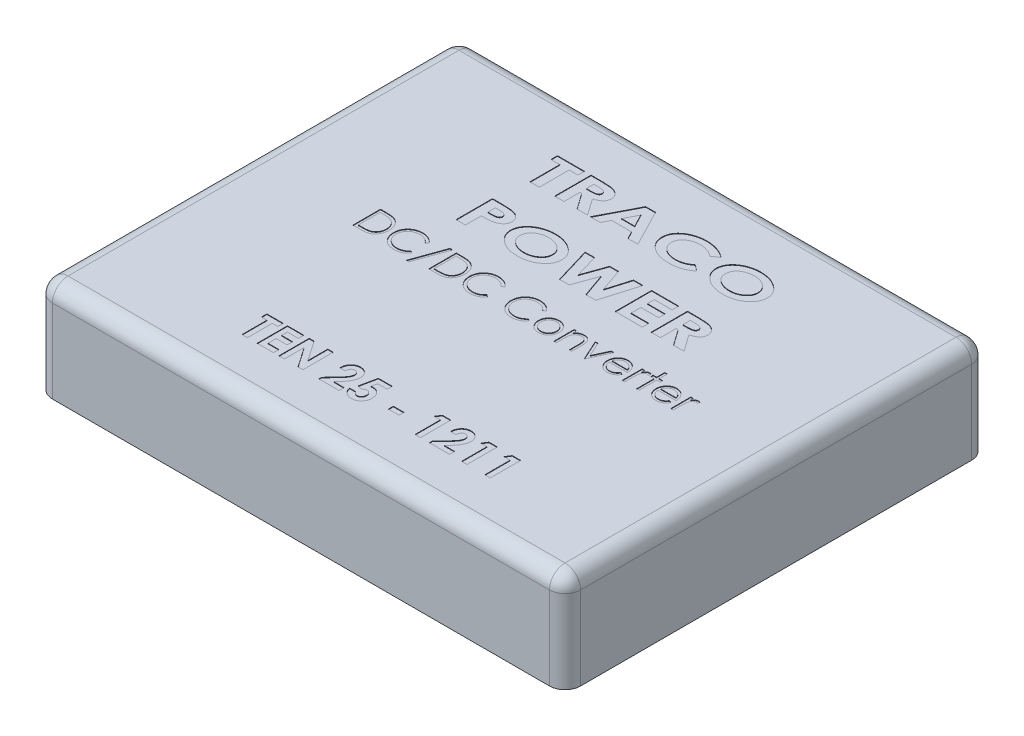
from build123d import *

# Parameters (mm, degrees)
ESQUISSE1_W             = 50.8
ESQUISSE1_H             = 40.6
BOSS_EXTRU_1_DEPTH      = 9.5
CONG_1_R                = 1.5
ENL_V_MAT_EXTRU_1_DEPTH = 0.05
ESQUISSE5_W             = 1.007451923
ESQUISSE5_H             = 0.485069445
ENL_V_MAT_EXTRU_2_DEPTH = 0.05
ENL_V_MAT_EXTRU_3_DEPTH = 0.05


with BuildPart() as part:
    # Esquisse1 → Boss.-Extru.1 (new body)
    with BuildSketch(Plane(origin=(0, 0, 0), x_dir=(1, 0, 0), z_dir=(0, 1, 0))):
        with Locations((25.4, 20.3)):
            Rectangle(ESQUISSE1_W, ESQUISSE1_H)
    extrude(amount=BOSS_EXTRU_1_DEPTH)

    # Congé1
    cong_1_edges = [part.edges().sort_by_distance(p)[0] for p in [
        (50.8, 9.5, -20.3),
        (25.4, 9.5, -40.6),
        (0, 9.5, -20.3),
        (25.4, 9.5, 0),
        (0, 4.75, -40.6),
        (50.8, 4.75, -40.6),
        (50.8, 4.75, 0),
        (0, 4.75, 0),
    ]]
    fillet(cong_1_edges, radius=CONG_1_R)

    # Esquisse3 → Enlèv. mat.-Extru.1 (cut)
    # profile 1 of 10: a face of its own
    with BuildSketch(Plane(origin=(0, 9.5, 0), x_dir=(1, 0, 0), z_dir=(0, 1, 0))):
        Polygon((15.019897998, 35.054731789), (17.6224621, 35.054731789), (17.6224621, 34.426526661), (16.769897998, 34.426526661), (16.769897998, 31.554731789), (15.8724621, 31.554731789), (15.8724621, 34.426526661), (15.019897998, 34.426526661), align=None)
    # profile 2 of 10: a face of its own
    with BuildSketch(Plane(origin=(0, 9.5, 0), x_dir=(1, 0, 0), z_dir=(0, 1, 0))):
        with BuildLine():
            Line((18.250667229, 35.054731789), (19.256777004, 35.054731789))
            add(Edge.make_bspline(
                [(19.256777004, 35.054731789), (19.323153734, 35.054552629), (19.451252932, 35.054206871), (19.635673886, 35.04907052), (19.805410075, 35.041705884), (19.95998637, 35.030786771), (20.100021655, 35.015992061), (20.224969924, 34.998901054), (20.335314059, 34.978913044), (20.432233568, 34.954859191), (20.519664886, 34.926794687), (20.601064448, 34.895512675), (20.677940453, 34.859308399), (20.750864026, 34.819783101), (20.819201406, 34.775021698), (20.883816019, 34.727054613), (20.943565391, 34.674013605), (20.998967028, 34.617585442), (21.048482137, 34.557392829), (21.092620047, 34.494627128), (21.129611618, 34.428826112), (21.160187657, 34.360367261), (21.183180383, 34.289057833), (21.200142182, 34.21544264), (21.210107205, 34.138871217), (21.211497414, 34.086978897), (21.21220569, 34.060541084)],
                knots=[0, 0, 0, 0, 1.942360821, 3.748525479, 5.398471571, 6.913875045, 8.282418781, 9.518505043, 10.603687565, 11.562434919, 12.438404284, 13.289346962, 14.112375837, 14.923468866, 15.714505135, 16.50100498, 17.276273883, 18.050093459, 18.812802014, 19.554618987, 20.292643093, 21.018300149, 21.744987786, 22.48161628, 23.226422243, 24, 24, 24, 24], degree=3))
            add(Edge.make_bspline(
                [(21.21220569, 34.060541084), (21.211644525, 34.032916474), (21.2105411, 33.978597876), (21.198503062, 33.899158448), (21.181551435, 33.822846216), (21.155929989, 33.750008487), (21.122950541, 33.680868658), (21.083241864, 33.614737407), (21.036342426, 33.552369804), (20.981524476, 33.494023829), (20.920676828, 33.438155373), (20.851056041, 33.387156818), (20.775054614, 33.338888423), (20.691230817, 33.294468489), (20.600511418, 33.253530637), (20.502492071, 33.215497118), (20.39717414, 33.18104812), (20.32376001, 33.161787533), (20.286023799, 33.151887238)],
                knots=[0, 0, 0, 0, 0.938261817, 1.844915378, 2.725580461, 3.592377074, 4.462987792, 5.325404772, 6.21039484, 7.109815044, 8.043390327, 9.01418199, 10.039020095, 11.101679491, 12.235815788, 13.420467275, 14.674072806, 16, 16, 16, 16], degree=3))
            Line((20.286023799, 33.151887238), (21.414128767, 31.554731789))
            Line((21.414128767, 31.554731789), (20.404513382, 31.554731789))
            Line((20.404513382, 31.554731789), (19.326889184, 33.080372815))
            Line((19.326889184, 33.080372815), (19.148103126, 33.080372815))
            Line((19.148103126, 33.080372815), (19.148103126, 31.554731789))
            Line((19.148103126, 31.554731789), (18.250667229, 31.554731789))
            Line((18.250667229, 31.554731789), (18.250667229, 35.054731789))
        make_face()
        with BuildLine():
            Line((19.148103126, 33.708577943), (19.465711299, 33.708577943))
            add(Edge.make_bspline(
                [(19.465711299, 33.708577943), (19.504507346, 33.708919397), (19.579077687, 33.709575711), (19.686205269, 33.71252446), (19.783684413, 33.719769282), (19.871593572, 33.728853886), (19.950413755, 33.739369004), (20.019615761, 33.754260777), (20.079830237, 33.77063837), (20.131099972, 33.790317056), (20.174858064, 33.813127448), (20.212509419, 33.838865249), (20.243722074, 33.869072225), (20.270262185, 33.901878826), (20.289765384, 33.939275354), (20.304811112, 33.979178682), (20.313297164, 34.023029961), (20.314266545, 34.05326053), (20.314769793, 34.068954545)],
                knots=[0, 0, 0, 0, 1.810256827, 3.479516111, 4.999140943, 6.369538748, 7.603227407, 8.706779841, 9.669889474, 10.512282949, 11.263419155, 11.968249844, 12.631536789, 13.283796803, 13.92780119, 14.590191195, 15.26810634, 16, 16, 16, 16], degree=3))
            add(Edge.make_bspline(
                [(20.314769793, 34.068954545), (20.313708269, 34.087539308), (20.311606736, 34.124332141), (20.294141971, 34.177552651), (20.264229916, 34.225822816), (20.224645829, 34.270255754), (20.175163106, 34.30911243), (20.118119481, 34.342839598), (20.053314072, 34.370347985), (19.993112354, 34.387763582), (19.937967365, 34.398494922), (19.888185006, 34.406294521), (19.830584799, 34.41217503), (19.76516837, 34.418016787), (19.691741964, 34.421984718), (19.610396527, 34.42478601), (19.521103065, 34.42596585), (19.458933868, 34.426334191), (19.426448479, 34.426526661)],
                knots=[0, 0, 0, 0, 0.842981993, 1.668877706, 2.511859699, 3.406725258, 4.358415719, 5.357990113, 6.409063649, 7.547987131, 8.197583625, 8.96033808, 9.836107581, 10.827075533, 11.943612093, 13.175842126, 14.52428738, 16, 16, 16, 16], degree=3))
            Line((19.426448479, 34.426526661), (19.148103126, 34.426526661))
            Line((19.148103126, 34.426526661), (19.148103126, 33.708577943))
        make_face(mode=Mode.SUBTRACT)
    # profile 3 of 10: a face of its own
    with BuildSketch(Plane(origin=(0, 9.5, 0), x_dir=(1, 0, 0), z_dir=(0, 1, 0))):
        Polygon((23.498563863, 35.054731789), (24.44648053, 35.054731789), (26.260282613, 31.554731789), (25.299044632, 31.554731789), (24.929553446, 32.272680507), (23.013387581, 32.272680507), (22.643195273, 31.554731789), (21.683359536, 31.554731789), align=None)
        Polygon((23.971821075, 34.115929706), (23.336604729, 32.900885635), (24.607037421, 32.900885635), align=None, mode=Mode.SUBTRACT)
    # profile 4 of 10: a face of its own
    with BuildSketch(Plane(origin=(0, 9.5, 0), x_dir=(1, 0, 0), z_dir=(0, 1, 0))):
        with BuildLine():
            Line((31.353231331, 34.447560315), (30.731336299, 34.007255827))
            add(Edge.make_bspline(
                [(30.731336299, 34.007255827), (30.678181881, 34.047819451), (30.573255626, 34.127891613), (30.407078194, 34.232316834), (30.235023203, 34.319023842), (30.058959705, 34.392220576), (29.877018022, 34.447345475), (29.690656038, 34.487489167), (29.499190188, 34.512075805), (29.369829793, 34.514863537), (29.304553446, 34.516270251)],
                knots=[0, 0, 0, 0, 1.038229587, 2.049454149, 3.043010366, 4.027894538, 5.007378552, 5.991352479, 6.986419527, 8, 8, 8, 8], degree=3))
            add(Edge.make_bspline(
                [(29.304553446, 34.516270251), (29.24982897, 34.51515858), (29.142241481, 34.512973054), (28.984214547, 34.496788793), (28.832879041, 34.469272099), (28.687980383, 34.431828128), (28.550011678, 34.382272745), (28.41819271, 34.322718091), (28.293216731, 34.251677033), (28.176233546, 34.170867981), (28.069260052, 34.082636201), (27.975448023, 33.987949569), (27.896269952, 33.887705199), (27.830999712, 33.782812616), (27.780672291, 33.672236429), (27.745043129, 33.55655402), (27.72230503, 33.435796167), (27.71985606, 33.353444413), (27.718615946, 33.311743007)],
                knots=[0, 0, 0, 0, 1.187885248, 2.335364319, 3.443960736, 4.524407058, 5.580322512, 6.622472728, 7.660799934, 8.696583053, 9.70539989, 10.666872381, 11.584427089, 12.472863723, 13.342442026, 14.213794558, 15.095498587, 16, 16, 16, 16], degree=3))
            add(Edge.make_bspline(
                [(27.718615946, 33.311743007), (27.719404475, 33.28251153), (27.720960079, 33.224843881), (27.729871632, 33.139398623), (27.746428679, 33.056820535), (27.767701949, 32.97635239), (27.796905846, 32.898889479), (27.832221031, 32.823872483), (27.872606326, 32.750450462), (27.920531072, 32.680688777), (27.973877835, 32.61381992), (28.032995632, 32.550830514), (28.096997024, 32.490896607), (28.166357168, 32.434889553), (28.241081673, 32.383019478), (28.320587062, 32.33437817), (28.405667675, 32.289609774), (28.495449278, 32.248376257), (28.589562684, 32.212321261), (28.686167111, 32.179617238), (28.785825005, 32.153282474), (28.887898572, 32.131686517), (28.992128033, 32.113706363), (29.099176113, 32.102441513), (29.20859726, 32.093957835), (29.282567462, 32.093450111), (29.319978126, 32.093193327)],
                knots=[0, 0, 0, 0, 0.937496524, 1.849486415, 2.750417344, 3.635754181, 4.515491188, 5.400574255, 6.292955863, 7.199200781, 8.110913523, 9.033495133, 9.966668607, 10.920525903, 11.889309348, 12.881519013, 13.907318609, 14.970354842, 16.047508483, 17.137618491, 18.239207974, 19.350391021, 20.482602104, 21.628789043, 22.800752546, 24, 24, 24, 24], degree=3))
            add(Edge.make_bspline(
                [(29.319978126, 32.093193327), (29.383133818, 32.094546324), (29.506976714, 32.097199434), (29.688749499, 32.117860833), (29.862091473, 32.151972069), (30.001277788, 32.192294479), (30.11028514, 32.232175773), (30.193006379, 32.269527894), (30.278533735, 32.310336891), (30.365549559, 32.357801207), (30.454865291, 32.410306452), (30.545475762, 32.469330674), (30.638544988, 32.533365092), (30.700378343, 32.578895756), (30.732037421, 32.602207751)],
                knots=[0, 0, 0, 0, 1.483690097, 2.90938903, 4.292193086, 5.630334046, 6.309691641, 7.01780335, 7.761982048, 8.53595548, 9.345892649, 10.195833925, 11.076255288, 12, 12, 12, 12], degree=3))
            Line((30.732037421, 32.602207751), (31.334301043, 32.13315727))
            add(Edge.make_bspline(
                [(31.334301043, 32.13315727), (31.291724389, 32.102734336), (31.20795592, 32.042877997), (31.08114879, 31.959319082), (30.955322973, 31.883892872), (30.832289296, 31.814138962), (30.710791221, 31.752031587), (30.590606146, 31.698481761), (30.472943975, 31.650004343), (30.355398258, 31.610172391), (30.236921244, 31.575065168), (30.115074999, 31.546181492), (29.98958306, 31.520623147), (29.859926138, 31.500550313), (29.726202978, 31.484201173), (29.588175697, 31.473453766), (29.446263527, 31.465942095), (29.350370359, 31.465309134), (29.301748959, 31.464988199)],
                knots=[0, 0, 0, 0, 1.151113728, 2.264786595, 3.339604625, 4.377795044, 5.375689211, 6.339863542, 7.27166599, 8.174026306, 9.068811971, 9.989082755, 10.927795337, 11.885464148, 12.874538463, 13.89070127, 14.930507155, 16, 16, 16, 16], degree=3))
            add(Edge.make_bspline(
                [(29.301748959, 31.464988199), (29.212889582, 31.466670317), (29.038817064, 31.46996553), (28.783834693, 31.493799555), (28.541291171, 31.534315258), (28.311205264, 31.590905378), (28.093539331, 31.663991422), (27.888059539, 31.752969743), (27.695002666, 31.858710353), (27.544433923, 31.959739069), (27.432096438, 32.047738553), (27.353115322, 32.115939879), (27.279882894, 32.186625992), (27.211268376, 32.258943049), (27.14872296, 32.334109146), (27.092184844, 32.411863734), (27.040559838, 32.491603528), (26.994224055, 32.573456502), (26.953723832, 32.657957743), (26.917462302, 32.744012719), (26.888316203, 32.83306129), (26.86351149, 32.924015096), (26.844937907, 33.017550532), (26.830439808, 33.112938813), (26.822993176, 33.210895208), (26.821789568, 33.276910154), (26.821180049, 33.310340763)],
                knots=[0, 0, 0, 0, 1.854242412, 3.632398211, 5.338628587, 6.981657757, 8.571767065, 10.124763514, 11.648247808, 13.15920557, 13.902647685, 14.625273405, 15.335833078, 16.025877133, 16.704660648, 17.374839119, 18.030956841, 18.686113137, 19.336148312, 19.985561112, 20.633323558, 21.289930521, 21.951823402, 22.622250278, 23.302294172, 24, 24, 24, 24], degree=3))
            add(Edge.make_bspline(
                [(26.821180049, 33.310340763), (26.822111967, 33.353385075), (26.823961062, 33.43879291), (26.839035959, 33.564723073), (26.863455082, 33.687248915), (26.898828374, 33.805505489), (26.943064755, 33.920871578), (26.997798312, 34.031912234), (27.062206029, 34.139598851), (27.136616733, 34.242985001), (27.219866773, 34.342523954), (27.312515995, 34.436893288), (27.413250396, 34.52636502), (27.522591576, 34.610997954), (27.640617113, 34.690036109), (27.767072162, 34.764405469), (27.901973614, 34.833744088), (28.044430259, 34.898013644), (28.192642732, 34.955587662), (28.344641109, 35.006479385), (28.499425059, 35.048907437), (28.657000429, 35.084545656), (28.817495797, 35.110455236), (28.980672444, 35.130716779), (29.146650581, 35.14166266), (29.258265451, 35.143534494), (29.314369152, 35.144475379)],
                knots=[0, 0, 0, 0, 0.901846024, 1.789428475, 2.653913408, 3.51710706, 4.373002704, 5.240410191, 6.108094187, 6.999707968, 7.907122633, 8.824946241, 9.768582249, 10.728662328, 11.720305377, 12.743416927, 13.801442477, 14.897498318, 16.01713447, 17.132283772, 18.255171826, 19.379276919, 20.51620885, 21.660742739, 22.824162147, 24, 24, 24, 24], degree=3))
            add(Edge.make_bspline(
                [(29.314369152, 35.144475379), (29.362526286, 35.143952422), (29.45821312, 35.142913323), (29.601105873, 35.134061947), (29.742698114, 35.120489445), (29.882665691, 35.099639454), (30.021544379, 35.074847615), (30.158619396, 35.042754604), (30.295026016, 35.006821911), (30.429058366, 34.963722853), (30.560531541, 34.916675775), (30.687498052, 34.863588681), (30.810609036, 34.807364266), (30.928146429, 34.744578345), (31.041535691, 34.677933406), (31.150194277, 34.606451347), (31.254424728, 34.530006312), (31.320322682, 34.47501988), (31.353231331, 34.447560315)],
                knots=[0, 0, 0, 0, 1.051020203, 2.088346762, 3.123802826, 4.154687706, 5.176241514, 6.202065689, 7.226608083, 8.254256982, 9.274064467, 10.273485341, 11.257160534, 12.22696929, 13.18055717, 14.127064957, 15.064678665, 16, 16, 16, 16], degree=3))
        make_face()
    # profile 5 of 10: a face of its own
    with BuildSketch(Plane(origin=(0, 9.5, 0), x_dir=(1, 0, 0), z_dir=(0, 1, 0))):
        with BuildLine():
            add(Edge.make_bspline(
                [(34.504072677, 35.144475379), (34.58663851, 35.142919494), (34.749127878, 35.139857517), (34.98840884, 35.11385983), (35.218896062, 35.072209451), (35.440715507, 35.013093415), (35.653742631, 34.937367601), (35.857854545, 34.844546124), (36.052856683, 34.734541008), (36.207065222, 34.6298671), (36.324026494, 34.539126928), (36.406520782, 34.469355594), (36.483668795, 34.397654795), (36.553842992, 34.323250124), (36.619991572, 34.248153532), (36.679151146, 34.170241145), (36.73348633, 34.091209218), (36.781386715, 34.009751524), (36.824067589, 33.92700739), (36.860707634, 33.841855947), (36.892496457, 33.755419678), (36.917388314, 33.666419465), (36.938183988, 33.576227018), (36.951889458, 33.48385307), (36.960645349, 33.389738634), (36.961682366, 33.326252705), (36.96220569, 33.294214962)],
                knots=[0, 0, 0, 0, 1.745145968, 3.434443253, 5.081950776, 6.692722788, 8.282073641, 9.856384965, 11.427133449, 13.009958241, 13.791714529, 14.555942899, 15.293528752, 16.016945007, 16.717403943, 17.408176707, 18.083798791, 18.743904067, 19.404619276, 20.050801644, 20.702570137, 21.350035736, 22.003319428, 22.658077529, 23.322807938, 24, 24, 24, 24], degree=3))
            add(Edge.make_bspline(
                [(36.96220569, 33.294214962), (36.96167041, 33.262646046), (36.960605871, 33.199863264), (36.951957708, 33.106662482), (36.937941824, 33.01510871), (36.918335371, 32.925403239), (36.893149014, 32.837530892), (36.861831684, 32.751845928), (36.826505916, 32.667359881), (36.784108223, 32.585352778), (36.73615026, 32.505177286), (36.683011023, 32.42656851), (36.62363044, 32.350294444), (36.560014601, 32.274764906), (36.489688814, 32.202016004), (36.413648686, 32.131417341), (36.333058284, 32.061466582), (36.217265473, 31.972423682), (36.064467996, 31.869178371), (35.871011765, 31.760484923), (35.667390221, 31.669310593), (35.454523437, 31.594110424), (35.231954431, 31.535812356), (34.999840024, 31.494750083), (34.758191964, 31.469817638), (34.593876061, 31.466615361), (34.510382773, 31.464988199)],
                knots=[0, 0, 0, 0, 0.67051785, 1.33349449, 1.986488314, 2.636986177, 3.282787654, 3.926658881, 4.573985186, 5.226771377, 5.885776778, 6.557745033, 7.240935207, 7.938283214, 8.654566243, 9.388675605, 10.142022968, 10.920566582, 12.49030535, 14.055074537, 15.628326538, 17.223646782, 18.845680182, 20.509983457, 22.226629637, 24, 24, 24, 24], degree=3))
            add(Edge.make_bspline(
                [(34.510382773, 31.464988199), (34.466203402, 31.465372072), (34.378967428, 31.466130061), (34.249433674, 31.472773447), (34.122840331, 31.482773736), (33.999022416, 31.498805029), (33.878022483, 31.517280399), (33.759619997, 31.540478261), (33.644313231, 31.568412322), (33.531972875, 31.60098508), (33.422033457, 31.636508627), (33.315160305, 31.677127001), (33.211105217, 31.722146924), (33.110009469, 31.771214675), (33.01165922, 31.824787575), (32.915717383, 31.881907803), (32.822969095, 31.943895378), (32.733724893, 32.009543387), (32.648319071, 32.077797417), (32.568528257, 32.148950852), (32.493331216, 32.220664108), (32.424323375, 32.294873974), (32.360549823, 32.370355428), (32.30222271, 32.44756679), (32.249530938, 32.526203072), (32.20221615, 32.606374413), (32.160956785, 32.68843124), (32.125010829, 32.771982098), (32.094997761, 32.857122818), (32.06946315, 32.943600978), (32.049647459, 33.031862833), (32.036850596, 33.121924178), (32.02781384, 33.213403209), (32.026813289, 33.275028367), (32.026308254, 33.306134033)],
                knots=[0, 0, 0, 0, 1.23785739, 2.444256004, 3.633631352, 4.795169465, 5.941806634, 7.063009603, 8.174840564, 9.265073711, 10.339876336, 11.411402117, 12.467345856, 13.515871935, 14.559067395, 15.604664997, 16.643576268, 17.683560242, 18.708340531, 19.705742031, 20.67834854, 21.618923025, 22.543772652, 23.446185256, 24.32889845, 25.1948367, 26.05293937, 26.900785464, 27.741724346, 28.581004192, 29.426266696, 30.273682739, 31.128631069, 32, 32, 32, 32], degree=3))
            add(Edge.make_bspline(
                [(32.026308254, 33.306134033), (32.027191734, 33.347548565), (32.028949951, 33.429967766), (32.04492878, 33.552205122), (32.070733174, 33.671898477), (32.107686248, 33.788773732), (32.154004304, 33.903219827), (32.210335042, 34.015554003), (32.277990499, 34.124692448), (32.355232205, 34.231171334), (32.440871306, 34.333880317), (32.535577203, 34.43083243), (32.637242, 34.522872076), (32.746915001, 34.609249872), (32.864527086, 34.689794046), (32.98915934, 34.765847931), (33.122369695, 34.834948398), (33.261976899, 34.899231287), (33.406701549, 34.957217739), (33.555523154, 35.00685965), (33.706702993, 35.05010843), (33.861180181, 35.083779997), (34.017760572, 35.111886939), (34.177491211, 35.130067704), (34.339800167, 35.142881439), (34.449125734, 35.143942227), (34.504072677, 35.144475379)],
                knots=[0, 0, 0, 0, 0.873545157, 1.738445156, 2.596414495, 3.454256273, 4.321472879, 5.199225574, 6.102525423, 7.027795969, 7.97301071, 8.9215899, 9.885252081, 10.86491977, 11.864845162, 12.891577554, 13.943741457, 15.029372765, 16.133759519, 17.231619976, 18.338470262, 19.449968713, 20.566368297, 21.693693259, 22.840852048, 24, 24, 24, 24], degree=3))
        make_face()
        with BuildLine():
            add(Edge.make_bspline(
                [(34.490751363, 34.516270251), (34.436488427, 34.515193459), (34.330054557, 34.513081391), (34.173774743, 34.496466115), (34.023872607, 34.470259027), (33.880613781, 34.43231041), (33.743930793, 34.383707045), (33.613619543, 34.325014353), (33.490550771, 34.254223855), (33.374781106, 34.174448126), (33.269530854, 34.086031819), (33.176489745, 33.991364856), (33.099393123, 33.889468861), (33.034205575, 33.783201565), (32.985208872, 33.669675076), (32.949191782, 33.55099711), (32.927600713, 33.426108022), (32.925045432, 33.341041054), (32.923744152, 33.297720571)],
                knots=[0, 0, 0, 0, 1.177915509, 2.310418757, 3.408289834, 4.479079589, 5.523885619, 6.554848934, 7.57758788, 8.602288603, 9.603464323, 10.55798171, 11.477463708, 12.372050713, 13.258222719, 14.153960245, 15.059901456, 16, 16, 16, 16], degree=3))
            add(Edge.make_bspline(
                [(32.923744152, 33.297720571), (32.925481059, 33.249681652), (32.92889785, 33.155180944), (32.956293912, 33.017631247), (33.000456311, 32.887564097), (33.064086252, 32.765947212), (33.144364743, 32.651302388), (33.244082142, 32.54595061), (33.360337228, 32.447510683), (33.447939524, 32.391348065), (33.493055049, 32.362424097)],
                knots=[0, 0, 0, 0, 1.002378203, 1.971848096, 2.916297197, 3.86133863, 4.827991989, 5.829253018, 6.882056827, 8, 8, 8, 8], degree=3))
            add(Edge.make_bspline(
                [(33.493055049, 32.362424097), (33.530121686, 32.34077641), (33.604404794, 32.297393532), (33.721790541, 32.243388988), (33.842775974, 32.196698695), (33.967942681, 32.158861247), (34.097045724, 32.129465006), (34.230312697, 32.108447106), (34.367565705, 32.095563484), (34.460575143, 32.093989005), (34.507578286, 32.093193327)],
                knots=[0, 0, 0, 0, 0.968643878, 1.941203282, 2.913290218, 3.894783287, 4.890638372, 5.900389362, 6.938943154, 8, 8, 8, 8], degree=3))
            add(Edge.make_bspline(
                [(34.507578286, 32.093193327), (34.560434546, 32.094308043), (34.664526937, 32.096503307), (34.817651901, 32.112723628), (34.964789798, 32.140241172), (35.106133677, 32.177814553), (35.241327272, 32.227005274), (35.37014265, 32.287753033), (35.493234128, 32.358850425), (35.609492283, 32.439258452), (35.715627684, 32.528224964), (35.808411548, 32.623811494), (35.888099654, 32.723908353), (35.952994588, 32.829523606), (36.003646529, 32.940603084), (36.038019167, 33.057052933), (36.061201226, 33.178081368), (36.063567999, 33.260684446), (36.064769793, 33.302628424)],
                knots=[0, 0, 0, 0, 1.159372101, 2.283207576, 3.373194553, 4.440212365, 5.487928247, 6.524559945, 7.560443406, 8.602890401, 9.621657833, 10.593309606, 11.520501184, 12.422635105, 13.306015146, 14.189915719, 15.080880085, 16, 16, 16, 16], degree=3))
            add(Edge.make_bspline(
                [(36.064769793, 33.302628424), (36.06352804, 33.344329239), (36.061075832, 33.426679826), (36.038361453, 33.547446227), (36.002580791, 33.663300454), (35.952377569, 33.774358711), (35.887195838, 33.880209642), (35.807217072, 33.980714341), (35.71330275, 34.076362279), (35.606491857, 34.165918198), (35.489853549, 34.248119437), (35.365158373, 34.319459163), (35.235016392, 34.381432616), (35.097747683, 34.429889514), (34.954800577, 34.468656116), (34.805784176, 34.496892769), (34.65026131, 34.512941837), (34.544540361, 34.515147863), (34.490751363, 34.516270251)],
                knots=[0, 0, 0, 0, 0.90719629, 1.791527272, 2.665475917, 3.542279041, 4.437696418, 5.365131948, 6.333100567, 7.351453338, 8.396138617, 9.435668054, 10.475956939, 11.53022765, 12.60045266, 13.698266854, 14.828917806, 16, 16, 16, 16], degree=3))
        make_face(mode=Mode.SUBTRACT)
    # profile 6 of 10: a face of its own
    with BuildSketch(Plane(origin=(0, 9.5, 0), x_dir=(1, 0, 0), z_dir=(0, 1, 0))):
        with BuildLine():
            Line((15.468615946, 28.35601384), (16.444577485, 28.35601384))
            add(Edge.make_bspline(
                [(16.444577485, 28.35601384), (16.508148613, 28.355809179), (16.630871269, 28.355414084), (16.808076332, 28.350600586), (16.97168949, 28.342046197), (17.121389177, 28.331424023), (17.257203084, 28.316496945), (17.379181349, 28.299529906), (17.487605755, 28.278728612), (17.583834393, 28.254014356), (17.670666513, 28.225195601), (17.751941033, 28.194230588), (17.827349515, 28.156941455), (17.899652352, 28.118426084), (17.966042426, 28.073587384), (18.028853026, 28.026207253), (18.086550065, 27.974110326), (18.139043017, 27.917852935), (18.18670394, 27.858908049), (18.227700502, 27.796294722), (18.263114129, 27.73135905), (18.290800946, 27.662669716), (18.313874569, 27.591860267), (18.328687066, 27.517472487), (18.339231463, 27.440651863), (18.340015153, 27.388269609), (18.340410818, 27.361823135)],
                knots=[0, 0, 0, 0, 1.900234888, 3.668361378, 5.29824944, 6.797419469, 8.153669347, 9.381710471, 10.477773137, 11.452059101, 12.348987854, 13.211691364, 14.049075643, 14.861973494, 15.658312658, 16.440772353, 17.212397831, 17.97846912, 18.738913567, 19.475196238, 20.212836479, 20.945830748, 21.685980875, 22.435435663, 23.210091095, 24, 24, 24, 24], degree=3))
            add(Edge.make_bspline(
                [(18.340410818, 27.361823135), (18.339621228, 27.332565593), (18.338066033, 27.274939248), (18.325226852, 27.190512591), (18.303904276, 27.110050421), (18.275310912, 27.032855321), (18.237205652, 26.959740166), (18.190294996, 26.890860403), (18.136311989, 26.824862415), (18.072529139, 26.764439011), (18.00283499, 26.707068684), (17.926803788, 26.654401893), (17.844898269, 26.606582714), (17.757018192, 26.56309336), (17.66300107, 26.524067205), (17.56317434, 26.488815437), (17.457323217, 26.458631325), (17.384180624, 26.442935629), (17.346921235, 26.434940122)],
                knots=[0, 0, 0, 0, 0.947754169, 1.866718941, 2.759471002, 3.641428849, 4.528897163, 5.423702711, 6.338100003, 7.286096209, 8.26548705, 9.261284238, 10.279606345, 11.336321123, 12.436199946, 13.576329595, 14.765363998, 16, 16, 16, 16], degree=3))
            add(Edge.make_bspline(
                [(17.346921235, 26.434940122), (17.32218728, 26.430474224), (17.268491277, 26.420779014), (17.180177628, 26.410960965), (17.078254175, 26.401964978), (16.96255139, 26.394202739), (16.833030086, 26.388922106), (16.689756608, 26.384814096), (16.532463822, 26.381812492), (16.423077958, 26.381708881), (16.366051844, 26.381654866)],
                knots=[0, 0, 0, 0, 0.613221355, 1.331268544, 2.167268072, 3.11042782, 4.160855784, 5.330565642, 6.608344223, 8, 8, 8, 8], degree=3))
            Line((16.366051844, 26.381654866), (16.366051844, 24.85601384))
            Line((16.366051844, 24.85601384), (15.468615946, 24.85601384))
            Line((15.468615946, 24.85601384), (15.468615946, 28.35601384))
        make_face()
        with BuildLine():
            Line((16.366051844, 27.009859994), (16.662626363, 27.009859994))
            add(Edge.make_bspline(
                [(16.662626363, 27.009859994), (16.690671569, 27.0100518), (16.7446619, 27.010421049), (16.822269292, 27.011621558), (16.893344872, 27.014323242), (16.957369856, 27.018660746), (17.014936071, 27.023278185), (17.065632747, 27.029717898), (17.109971296, 27.036273758), (17.158986547, 27.047409832), (17.212770942, 27.064939677), (17.270832883, 27.091521817), (17.321845601, 27.123757294), (17.365252527, 27.161824835), (17.400004588, 27.205397548), (17.424981612, 27.253976524), (17.440347658, 27.306915241), (17.442086692, 27.343723871), (17.442974921, 27.362524257)],
                knots=[0, 0, 0, 0, 1.407605413, 2.709806541, 3.895428679, 4.976847854, 5.930489772, 6.793236331, 7.541454841, 8.178861105, 9.313911922, 10.374001262, 11.376181959, 12.331769573, 13.258707867, 14.155775968, 15.058043621, 16, 16, 16, 16], degree=3))
            add(Edge.make_bspline(
                [(17.442974921, 27.362524257), (17.442355771, 27.378947775), (17.441148086, 27.410982737), (17.430139291, 27.457065378), (17.413152952, 27.499950325), (17.389325008, 27.539800715), (17.356963294, 27.574886165), (17.318482897, 27.60645447), (17.274095698, 27.636047464), (17.240392544, 27.650738853), (17.222822677, 27.658397654)],
                knots=[0, 0, 0, 0, 0.99967641, 1.949923027, 2.870450112, 3.803674722, 4.761895576, 5.763194509, 6.833925937, 8, 8, 8, 8], degree=3))
            add(Edge.make_bspline(
                [(17.222822677, 27.658397654), (17.208190375, 27.664048958), (17.17662322, 27.676240858), (17.12343833, 27.689743369), (17.062072447, 27.70139205), (16.992104444, 27.711170946), (16.913734732, 27.718605549), (16.826533228, 27.724385231), (16.730879879, 27.726658138), (16.664262408, 27.727415486), (16.629673639, 27.727808712)],
                knots=[0, 0, 0, 0, 0.626672195, 1.351958081, 2.189428709, 3.123683958, 4.175242118, 5.336301276, 6.616968516, 8, 8, 8, 8], degree=3))
            Line((16.629673639, 27.727808712), (16.366051844, 27.727808712))
            Line((16.366051844, 27.727808712), (16.366051844, 27.009859994))
        make_face(mode=Mode.SUBTRACT)
    # profile 7 of 10: a face of its own
    with BuildSketch(Plane(origin=(0, 9.5, 0), x_dir=(1, 0, 0), z_dir=(0, 1, 0))):
        with BuildLine():
            add(Edge.make_bspline(
                [(21.44638037, 28.44575743), (21.528946202, 28.444201546), (21.69143557, 28.441139569), (21.930716532, 28.415141881), (22.161203754, 28.373491502), (22.383023199, 28.314375466), (22.596050324, 28.238649652), (22.800162237, 28.145828175), (22.995164375, 28.03582306), (23.149372914, 27.931149151), (23.266334186, 27.840408979), (23.348828475, 27.770637646), (23.425976487, 27.698936846), (23.496150684, 27.624532175), (23.562299265, 27.549435583), (23.621458838, 27.471523196), (23.675794022, 27.392491269), (23.723694408, 27.311033575), (23.766375281, 27.228289441), (23.803015326, 27.143137998), (23.83480415, 27.056701729), (23.859696007, 26.967701516), (23.88049168, 26.877509069), (23.89419715, 26.785135121), (23.902953042, 26.691020686), (23.903990059, 26.627534756), (23.904513382, 26.595497013)],
                knots=[0, 0, 0, 0, 1.745145968, 3.434443253, 5.081950776, 6.692722788, 8.282073641, 9.856384965, 11.427133449, 13.009958241, 13.791714529, 14.555942899, 15.293528752, 16.016945007, 16.717403943, 17.408176707, 18.083798791, 18.743904067, 19.404619276, 20.050801644, 20.702570137, 21.350035736, 22.003319428, 22.658077529, 23.322807938, 24, 24, 24, 24], degree=3))
            add(Edge.make_bspline(
                [(23.904513382, 26.595497013), (23.903978103, 26.563928097), (23.902913564, 26.501145315), (23.8942654, 26.407944533), (23.880249516, 26.316390762), (23.860643063, 26.22668529), (23.835456707, 26.138812944), (23.804139376, 26.053127979), (23.768813608, 25.968641932), (23.726415915, 25.886634829), (23.678457952, 25.806459337), (23.625318715, 25.727850562), (23.565938132, 25.651576496), (23.502322294, 25.576046958), (23.431996507, 25.503298055), (23.355956378, 25.432699393), (23.275365976, 25.362748633), (23.159573165, 25.273705734), (23.006775689, 25.170460422), (22.813319457, 25.061766974), (22.609697914, 24.970592644), (22.396831129, 24.895392476), (22.174262123, 24.837094407), (21.942147716, 24.796032134), (21.700499656, 24.771099689), (21.536183753, 24.767897413), (21.452690466, 24.766270251)],
                knots=[0, 0, 0, 0, 0.67051785, 1.33349449, 1.986488314, 2.636986177, 3.282787654, 3.926658881, 4.573985186, 5.226771377, 5.885776778, 6.557745033, 7.240935207, 7.938283214, 8.654566243, 9.388675605, 10.142022968, 10.920566582, 12.49030535, 14.055074537, 15.628326538, 17.223646782, 18.845680182, 20.509983457, 22.226629637, 24, 24, 24, 24], degree=3))
            add(Edge.make_bspline(
                [(21.452690466, 24.766270251), (21.408511094, 24.766654123), (21.32127512, 24.767412112), (21.191741366, 24.774055499), (21.065148023, 24.784055787), (20.941330109, 24.80008708), (20.820330175, 24.818562451), (20.701927689, 24.841760312), (20.586620923, 24.869694373), (20.474280567, 24.902267131), (20.364341149, 24.937790678), (20.257467997, 24.978409052), (20.153412909, 25.023428975), (20.052317161, 25.072496727), (19.953966912, 25.126069627), (19.858025075, 25.183189855), (19.765276787, 25.24517743), (19.676032586, 25.310825439), (19.590626763, 25.379079468), (19.51083595, 25.450232903), (19.435638908, 25.52194616), (19.366631068, 25.596156026), (19.302857516, 25.671637479), (19.244530403, 25.748848841), (19.19183863, 25.827485123), (19.144523842, 25.907656464), (19.103264477, 25.989713292), (19.067318521, 26.07326415), (19.037305454, 26.15840487), (19.011770843, 26.244883029), (18.991955152, 26.333144884), (18.979158288, 26.42320623), (18.970121533, 26.514685261), (18.969120981, 26.576310418), (18.968615946, 26.607416084)],
                knots=[0, 0, 0, 0, 1.23785739, 2.444256004, 3.633631352, 4.795169465, 5.941806634, 7.063009603, 8.174840564, 9.265073711, 10.339876336, 11.411402117, 12.467345856, 13.515871935, 14.559067395, 15.604664997, 16.643576268, 17.683560242, 18.708340531, 19.705742031, 20.67834854, 21.618923025, 22.543772652, 23.446185256, 24.32889845, 25.1948367, 26.05293937, 26.900785464, 27.741724346, 28.581004192, 29.426266696, 30.273682739, 31.128631069, 32, 32, 32, 32], degree=3))
            add(Edge.make_bspline(
                [(18.968615946, 26.607416084), (18.969499427, 26.648830617), (18.971257644, 26.731249817), (18.987236472, 26.853487173), (19.013040866, 26.973180528), (19.04999394, 27.090055783), (19.096311997, 27.204501879), (19.152642735, 27.316836055), (19.220298191, 27.425974499), (19.297539897, 27.532453385), (19.383178998, 27.635162368), (19.477884895, 27.732114482), (19.579549692, 27.824154128), (19.689222694, 27.910531923), (19.806834779, 27.991076098), (19.931467033, 28.067129983), (20.064677387, 28.136230449), (20.204284591, 28.200513338), (20.349009241, 28.25849979), (20.497830846, 28.308141701), (20.649010685, 28.351390481), (20.803487874, 28.385062048), (20.960068264, 28.413168991), (21.119798903, 28.431349755), (21.282107859, 28.44416349), (21.391433426, 28.445224278), (21.44638037, 28.44575743)],
                knots=[0, 0, 0, 0, 0.873545157, 1.738445156, 2.596414495, 3.454256273, 4.321472879, 5.199225574, 6.102525423, 7.027795969, 7.97301071, 8.9215899, 9.885252081, 10.86491977, 11.864845162, 12.891577554, 13.943741457, 15.029372765, 16.133759519, 17.231619976, 18.338470262, 19.449968713, 20.566368297, 21.693693259, 22.840852048, 24, 24, 24, 24], degree=3))
        make_face()
        with BuildLine():
            add(Edge.make_bspline(
                [(21.433059055, 27.817552302), (21.378796119, 27.816475511), (21.272362249, 27.814363442), (21.116082435, 27.797748166), (20.966180299, 27.771541078), (20.822921473, 27.733592461), (20.686238486, 27.684989097), (20.555927236, 27.626296404), (20.432858463, 27.555505906), (20.317088798, 27.475730177), (20.211838547, 27.38731387), (20.118797438, 27.292646907), (20.041700815, 27.190750912), (19.976513267, 27.084483617), (19.927516565, 26.970957128), (19.891499475, 26.852279161), (19.869908406, 26.727390073), (19.867353125, 26.642323105), (19.866051844, 26.599002622)],
                knots=[0, 0, 0, 0, 1.177915509, 2.310418757, 3.408289834, 4.479079589, 5.523885619, 6.554848934, 7.57758788, 8.602288603, 9.603464323, 10.55798171, 11.477463708, 12.372050713, 13.258222719, 14.153960245, 15.059901456, 16, 16, 16, 16], degree=3))
            add(Edge.make_bspline(
                [(19.866051844, 26.599002622), (19.867788751, 26.550963704), (19.871205542, 26.456462995), (19.898601604, 26.318913299), (19.942764003, 26.188846149), (20.006393944, 26.067229264), (20.086672435, 25.952584439), (20.186389834, 25.847232661), (20.30264492, 25.748792734), (20.390247217, 25.692630116), (20.435362741, 25.663706148)],
                knots=[0, 0, 0, 0, 1.002378203, 1.971848096, 2.916297197, 3.86133863, 4.827991989, 5.829253018, 6.882056827, 8, 8, 8, 8], degree=3))
            add(Edge.make_bspline(
                [(20.435362741, 25.663706148), (20.472429378, 25.642058462), (20.546712486, 25.598675583), (20.664098234, 25.54467104), (20.785083666, 25.497980747), (20.910250373, 25.460143298), (21.039353416, 25.430747057), (21.172620389, 25.409729157), (21.309873397, 25.396845536), (21.402882835, 25.395271056), (21.449885979, 25.394475379)],
                knots=[0, 0, 0, 0, 0.968643878, 1.941203282, 2.913290218, 3.894783287, 4.890638372, 5.900389362, 6.938943154, 8, 8, 8, 8], degree=3))
            add(Edge.make_bspline(
                [(21.449885979, 25.394475379), (21.502742239, 25.395590095), (21.606834629, 25.397785358), (21.759959594, 25.414005679), (21.90709749, 25.441523223), (22.04844137, 25.479096605), (22.183634965, 25.528287326), (22.312450342, 25.589035084), (22.435541821, 25.660132476), (22.551799976, 25.740540504), (22.657935377, 25.829507015), (22.75071924, 25.925093546), (22.830407347, 26.025190404), (22.89530228, 26.130805657), (22.945954221, 26.241885135), (22.980326859, 26.358334985), (23.003508919, 26.47936342), (23.005875691, 26.561966498), (23.007077485, 26.603910475)],
                knots=[0, 0, 0, 0, 1.159372101, 2.283207576, 3.373194553, 4.440212365, 5.487928247, 6.524559945, 7.560443406, 8.602890401, 9.621657833, 10.593309606, 11.520501184, 12.422635105, 13.306015146, 14.189915719, 15.080880085, 16, 16, 16, 16], degree=3))
            add(Edge.make_bspline(
                [(23.007077485, 26.603910475), (23.005835732, 26.64561129), (23.003383525, 26.727961877), (22.980669145, 26.848728278), (22.944888484, 26.964582505), (22.894685262, 27.075640762), (22.82950353, 27.181491693), (22.749524764, 27.281996393), (22.655610442, 27.37764433), (22.548799549, 27.46720025), (22.432161241, 27.549401488), (22.307466066, 27.620741214), (22.177324085, 27.682714667), (22.040055375, 27.731171566), (21.89710827, 27.769938167), (21.748091868, 27.79817482), (21.592569002, 27.814223889), (21.486848054, 27.816429914), (21.433059055, 27.817552302)],
                knots=[0, 0, 0, 0, 0.90719629, 1.791527272, 2.665475917, 3.542279041, 4.437696418, 5.365131948, 6.333100567, 7.351453338, 8.396138617, 9.435668054, 10.475956939, 11.53022765, 12.60045266, 13.698266854, 14.828917806, 16, 16, 16, 16], degree=3))
        make_face(mode=Mode.SUBTRACT)
    # profile 8 of 10: a face of its own
    with BuildSketch(Plane(origin=(0, 9.5, 0), x_dir=(1, 0, 0), z_dir=(0, 1, 0))):
        Polygon((24.375667229, 28.35601384), (25.283619953, 28.35601384), (25.946180049, 26.12153868), (26.741252164, 28.35601384), (27.579092709, 28.35601384), (28.369256972, 26.12153868), (29.030414825, 28.35601384), (29.939769793, 28.35601384), (28.904212902, 24.85601384), (27.9583996, 24.85601384), (27.157718511, 27.118533872), (26.35283069, 24.85601384), (25.413327485, 24.85601384), align=None)
    # profile 9 of 10: a face of its own
    with BuildSketch(Plane(origin=(0, 9.5, 0), x_dir=(1, 0, 0), z_dir=(0, 1, 0))):
        Polygon((30.769897998, 28.35601384), (33.3724621, 28.35601384), (33.3724621, 27.727808712), (31.667333895, 27.727808712), (31.667333895, 27.054731789), (33.3724621, 27.054731789), (33.3724621, 26.426526661), (31.667333895, 26.426526661), (31.667333895, 25.484218968), (33.3724621, 25.484218968), (33.3724621, 24.85601384), (30.769897998, 24.85601384), align=None)
    # profile 10 of 10: a face of its own
    with BuildSketch(Plane(origin=(0, 9.5, 0), x_dir=(1, 0, 0), z_dir=(0, 1, 0))):
        with BuildLine():
            Line((34.225026203, 28.35601384), (35.231135979, 28.35601384))
            add(Edge.make_bspline(
                [(35.231135979, 28.35601384), (35.297512708, 28.35583468), (35.425611906, 28.355488922), (35.610032861, 28.350352572), (35.779769049, 28.342987936), (35.934345344, 28.332068822), (36.07438063, 28.317274112), (36.199328899, 28.300183105), (36.309673034, 28.280195095), (36.406592543, 28.256141242), (36.49402386, 28.228076739), (36.575423422, 28.196794726), (36.652299427, 28.160590451), (36.725223, 28.121065153), (36.793560381, 28.07630375), (36.858174993, 28.028336665), (36.917924365, 27.975295656), (36.973326002, 27.918867494), (37.022841112, 27.85867488), (37.066979021, 27.795909179), (37.103970593, 27.730108163), (37.134546631, 27.661649312), (37.157539357, 27.590339884), (37.174501156, 27.516724691), (37.18446618, 27.440153269), (37.185856389, 27.388260948), (37.186564664, 27.361823135)],
                knots=[0, 0, 0, 0, 1.942360821, 3.748525479, 5.398471571, 6.913875045, 8.282418781, 9.518505043, 10.603687565, 11.562434919, 12.438404284, 13.289346962, 14.112375837, 14.923468866, 15.714505135, 16.50100498, 17.276273883, 18.050093459, 18.812802014, 19.554618987, 20.292643093, 21.018300149, 21.744987786, 22.48161628, 23.226422243, 24, 24, 24, 24], degree=3))
            add(Edge.make_bspline(
                [(37.186564664, 27.361823135), (37.186003499, 27.334198526), (37.184900074, 27.279879927), (37.172862037, 27.2004405), (37.15591041, 27.124128267), (37.130288964, 27.051290538), (37.097309516, 26.982150709), (37.057600838, 26.916019459), (37.0107014, 26.853651855), (36.95588345, 26.79530588), (36.895035802, 26.739437424), (36.825415015, 26.68843887), (36.749413589, 26.640170474), (36.665589791, 26.59575054), (36.574870392, 26.554812688), (36.476851046, 26.51677917), (36.371533115, 26.482330171), (36.298118985, 26.463069584), (36.260382773, 26.453169289)],
                knots=[0, 0, 0, 0, 0.938261817, 1.844915378, 2.725580461, 3.592377074, 4.462987792, 5.325404772, 6.21039484, 7.109815044, 8.043390327, 9.01418199, 10.039020095, 11.101679491, 12.235815788, 13.420467275, 14.674072806, 16, 16, 16, 16], degree=3))
            Line((36.260382773, 26.453169289), (37.388487741, 24.85601384))
            Line((37.388487741, 24.85601384), (36.378872357, 24.85601384))
            Line((36.378872357, 24.85601384), (35.301248158, 26.381654866))
            Line((35.301248158, 26.381654866), (35.1224621, 26.381654866))
            Line((35.1224621, 26.381654866), (35.1224621, 24.85601384))
            Line((35.1224621, 24.85601384), (34.225026203, 24.85601384))
            Line((34.225026203, 24.85601384), (34.225026203, 28.35601384))
        make_face()
        with BuildLine():
            Line((35.1224621, 27.009859994), (35.440070273, 27.009859994))
            add(Edge.make_bspline(
                [(35.440070273, 27.009859994), (35.47886632, 27.010201449), (35.553436661, 27.010857763), (35.660564244, 27.013806511), (35.758043387, 27.021051333), (35.845952546, 27.030135937), (35.924772729, 27.040651055), (35.993974736, 27.055542829), (36.054189211, 27.071920421), (36.105458947, 27.091599107), (36.149217038, 27.114409499), (36.186868394, 27.1401473), (36.218081049, 27.170354276), (36.244621159, 27.203160877), (36.264124358, 27.240557405), (36.279170087, 27.280460733), (36.287656139, 27.324312012), (36.288625519, 27.354542581), (36.289128767, 27.370236597)],
                knots=[0, 0, 0, 0, 1.810256827, 3.479516111, 4.999140943, 6.369538748, 7.603227407, 8.706779841, 9.669889474, 10.512282949, 11.263419155, 11.968249844, 12.631536789, 13.283796803, 13.92780119, 14.590191195, 15.26810634, 16, 16, 16, 16], degree=3))
            add(Edge.make_bspline(
                [(36.289128767, 27.370236597), (36.288067243, 27.388821359), (36.285965711, 27.425614192), (36.268500945, 27.478834703), (36.238588891, 27.527104867), (36.199004803, 27.571537806), (36.149522081, 27.610394481), (36.092478455, 27.644121649), (36.027673047, 27.671630036), (35.967471329, 27.689045633), (35.912326339, 27.699776973), (35.86254398, 27.707576573), (35.804943774, 27.713457081), (35.739527344, 27.719298838), (35.666100939, 27.723266769), (35.584755501, 27.726068061), (35.495462039, 27.727247902), (35.433292842, 27.727616242), (35.400807453, 27.727808712)],
                knots=[0, 0, 0, 0, 0.842981993, 1.668877706, 2.511859699, 3.406725258, 4.358415719, 5.357990113, 6.409063649, 7.547987131, 8.197583625, 8.96033808, 9.836107581, 10.827075533, 11.943612093, 13.175842126, 14.52428738, 16, 16, 16, 16], degree=3))
            Line((35.400807453, 27.727808712), (35.1224621, 27.727808712))
            Line((35.1224621, 27.727808712), (35.1224621, 27.009859994))
        make_face(mode=Mode.SUBTRACT)
    extrude(amount=-ENL_V_MAT_EXTRU_1_DEPTH, mode=Mode.SUBTRACT)

    # Esquisse5 → Enlèv. mat.-Extru.2 (cut)
    with BuildSketch(Plane(origin=(0, 9.5, 0), x_dir=(1, 0, 0), z_dir=(0, 1, 0))):
        Polygon((14.223594583, 7.903987772), (15.790742019, 7.903987772), (15.790742019, 7.381605293), (15.26835954, 7.381605293), (15.26835954, 4.993571105), (14.745977061, 4.993571105), (14.745977061, 7.381605293), (14.223594583, 7.381605293), align=None)
        Polygon((16.201185395, 7.903987772), (17.768332831, 7.903987772), (17.768332831, 7.381605293), (16.723567873, 7.381605293), (16.723567873, 6.82190978), (17.768332831, 6.82190978), (17.768332831, 6.299527302), (16.723567873, 6.299527302), (16.723567873, 5.515953584), (17.768332831, 5.515953584), (17.768332831, 4.993571105), (16.201185395, 4.993571105), align=None)
        Polygon((18.290715309, 7.903987772), (18.76120935, 7.903987772), (20.08174095, 5.988779689), (20.08174095, 7.903987772), (20.604123429, 7.903987772), (20.604123429, 4.993571105), (20.130131292, 4.993571105), (18.813097788, 6.902949026), (18.813097788, 4.993571105), (18.290715309, 4.993571105), align=None)
        with BuildLine():
            Line((22.730966378, 6.933848883), (22.208583899, 6.933848883))
            add(Edge.make_bspline(
                [(22.208583899, 6.933848883), (22.210839989, 6.973364354), (22.215248253, 7.050575211), (22.232783213, 7.162726454), (22.256279458, 7.268697046), (22.287638316, 7.368116291), (22.327042772, 7.460948061), (22.37347885, 7.547508827), (22.428132884, 7.627342844), (22.489841658, 7.700065107), (22.557557526, 7.76530492), (22.62987464, 7.823150637), (22.707899189, 7.870883466), (22.790205598, 7.910163166), (22.876779855, 7.941545821), (22.968441086, 7.962527665), (23.06439564, 7.976736776), (23.130084302, 7.97798013), (23.163564368, 7.97861384)],
                knots=[0, 0, 0, 0, 1.199038563, 2.342849363, 3.436047546, 4.486744587, 5.497670872, 6.488682221, 7.459191391, 8.424610317, 9.374430501, 10.305433194, 11.225809216, 12.140057399, 13.06607119, 14.010487599, 14.985989317, 16, 16, 16, 16], degree=3))
            add(Edge.make_bspline(
                [(23.163564368, 7.97861384), (23.204660673, 7.977331527), (23.284890292, 7.974828151), (23.401470292, 7.953473527), (23.510343265, 7.917754617), (23.611430072, 7.86784588), (23.703870142, 7.804442061), (23.787648146, 7.728843384), (23.860230504, 7.639463749), (23.922077409, 7.540022096), (23.973464796, 7.434727381), (24.009474936, 7.325848279), (24.033144013, 7.216274001), (24.035668467, 7.142492228), (24.036922574, 7.10583865)],
                knots=[0, 0, 0, 0, 1.075374347, 2.099382735, 3.09057751, 4.06680945, 5.040638231, 6.016817125, 7.011024321, 8.044445721, 9.0776792, 10.070479129, 11.0414456, 12, 12, 12, 12], degree=3))
            add(Edge.make_bspline(
                [(24.036922574, 7.10583865), (24.036434291, 7.083667975), (24.035451498, 7.039043884), (24.028618005, 6.971516682), (24.018366416, 6.902732332), (24.002909518, 6.83274981), (23.983633498, 6.761549499), (23.9602489, 6.68891832), (23.932213296, 6.615268066), (23.899994541, 6.539769816), (23.861557486, 6.462178457), (23.816802877, 6.381330864), (23.764542827, 6.297298755), (23.705408571, 6.209607657), (23.639112908, 6.118395874), (23.565332204, 6.023938162), (23.48491624, 5.925901684), (23.427842768, 5.8603698), (23.39851988, 5.826701197)],
                knots=[0, 0, 0, 0, 0.728284026, 1.46585585, 2.227944881, 3.01186502, 3.81876927, 4.650621989, 5.517437689, 6.406905708, 7.346299482, 8.360816762, 9.441613733, 10.596154504, 11.834900912, 13.145207542, 14.533280747, 16, 16, 16, 16], degree=3))
            Line((23.39851988, 5.826701197), (23.094768461, 5.47864055))
            Line((23.094768461, 5.47864055), (24.074235608, 5.47864055))
            Line((24.074235608, 5.47864055), (24.074235608, 4.993571105))
            Line((24.074235608, 4.993571105), (22.133957831, 4.993571105))
            Line((22.133957831, 4.993571105), (22.133957831, 5.258260441))
            Line((22.133957831, 5.258260441), (22.995655714, 6.17534486))
            add(Edge.make_bspline(
                [(22.995655714, 6.17534486), (23.020604082, 6.202096497), (23.068921672, 6.253906485), (23.137672624, 6.329994964), (23.199886163, 6.402201115), (23.254272239, 6.471293787), (23.303684965, 6.535031895), (23.345921031, 6.595336585), (23.381366863, 6.651662682), (23.419848342, 6.719582116), (23.456393096, 6.800588129), (23.489925121, 6.893910376), (23.51036521, 6.983104952), (23.513186589, 7.041226055), (23.514540096, 7.069108632)],
                knots=[0, 0, 0, 0, 1.246127091, 2.413378631, 3.493388633, 4.492180848, 5.408488754, 6.240484944, 6.999099869, 7.674939598, 8.898438119, 10.020720584, 11.050475521, 12, 12, 12, 12], degree=3))
            add(Edge.make_bspline(
                [(23.514540096, 7.069108632), (23.513528111, 7.096082874), (23.511567229, 7.148349792), (23.490018726, 7.222699205), (23.456635038, 7.290015008), (23.409592706, 7.348285731), (23.352609708, 7.396170647), (23.286760502, 7.431786102), (23.212581952, 7.452336057), (23.160581375, 7.454908177), (23.133830544, 7.456231362)],
                knots=[0, 0, 0, 0, 1.062038974, 2.057870785, 3.028805853, 4.01125022, 4.991535629, 5.949134679, 6.94496649, 8, 8, 8, 8], degree=3))
            add(Edge.make_bspline(
                [(23.133830544, 7.456231362), (23.120010724, 7.455742561), (23.092804189, 7.45478028), (23.052812709, 7.448374631), (23.014757943, 7.437085345), (22.978216319, 7.42195929), (22.94357782, 7.401909595), (22.910929816, 7.377195153), (22.879928317, 7.348444012), (22.850715509, 7.315746074), (22.824128041, 7.279255165), (22.800513149, 7.239304556), (22.780987564, 7.195919045), (22.76379653, 7.149671387), (22.750537982, 7.100064844), (22.740884114, 7.047396306), (22.733544923, 6.991751459), (22.731841529, 6.953500858), (22.730966378, 6.933848883)],
                knots=[0, 0, 0, 0, 0.903469896, 1.778625579, 2.63899355, 3.493148037, 4.358286772, 5.247621495, 6.164656832, 7.118446693, 8.109501108, 9.111810964, 10.146451449, 11.215617525, 12.33435995, 13.498009769, 14.714554818, 16, 16, 16, 16], degree=3))
        make_face()
        with BuildLine():
            Line((24.950508896, 7.903987772), (26.275704626, 7.903987772))
            Line((26.275704626, 7.903987772), (26.275704626, 7.418918327))
            Line((26.275704626, 7.418918327), (25.364450369, 7.418918327))
            Line((25.364450369, 7.418918327), (25.250762218, 6.868551073))
            add(Edge.make_bspline(
                [(25.250762218, 6.868551073), (25.266253856, 6.87286569), (25.296806549, 6.881375001), (25.342834219, 6.889908763), (25.387441445, 6.895440076), (25.416712435, 6.896177879), (25.430914211, 6.896535849)],
                knots=[0, 0, 0, 0, 1.05461699, 2.079921384, 3.068411212, 4, 4, 4, 4], degree=3))
            add(Edge.make_bspline(
                [(25.430914211, 6.896535849), (25.461861368, 6.895826713), (25.522865032, 6.894428849), (25.612105651, 6.881158564), (25.697558816, 6.860258267), (25.778963031, 6.830450131), (25.856238773, 6.791654072), (25.929479718, 6.744721717), (25.998775755, 6.689570634), (26.062895896, 6.626166295), (26.121812159, 6.556546895), (26.17303649, 6.481246147), (26.216785266, 6.401337767), (26.251581529, 6.316325046), (26.279045707, 6.226741922), (26.298891935, 6.132530985), (26.310628001, 6.033580583), (26.312210537, 5.966073799), (26.31301766, 5.931644105)],
                knots=[0, 0, 0, 0, 1.01440847, 1.999622559, 2.951875003, 3.895578053, 4.836219714, 5.782137149, 6.743708247, 7.735272588, 8.734977101, 9.730283169, 10.717124674, 11.717316708, 12.737475749, 13.78628267, 14.87096371, 16, 16, 16, 16], degree=3))
            add(Edge.make_bspline(
                [(26.31301766, 5.931644105), (26.312031343, 5.896823555), (26.310085052, 5.82811243), (26.297387285, 5.727082772), (26.274975498, 5.630319168), (26.244190667, 5.537562583), (26.203633622, 5.449494756), (26.154858225, 5.365203371), (26.097039815, 5.285314095), (26.030745789, 5.21064589), (25.958675487, 5.142397717), (25.881937628, 5.082359669), (25.801071318, 5.031838138), (25.716074608, 4.991008199), (25.627435148, 4.958704279), (25.535126038, 4.935188567), (25.438698665, 4.921703612), (25.373237008, 4.919874666), (25.33996369, 4.918945037)],
                knots=[0, 0, 0, 0, 1.06808661, 2.107647099, 3.116961351, 4.110378221, 5.100014249, 6.085620622, 7.093190682, 8.119403071, 9.144090782, 10.133780668, 11.103064255, 12.062861538, 13.020824475, 13.992378307, 14.979551724, 16, 16, 16, 16], degree=3))
            add(Edge.make_bspline(
                [(25.33996369, 4.918945037), (25.310208352, 4.919705532), (25.251524599, 4.921205387), (25.165086006, 4.930424288), (25.081749605, 4.94672339), (25.001957819, 4.970312412), (24.924871105, 4.999345113), (24.851380609, 5.035655993), (24.781082487, 5.078553642), (24.71417636, 5.127255179), (24.651749356, 5.182115571), (24.594772602, 5.242169722), (24.542901153, 5.306660679), (24.497244977, 5.376384065), (24.457947192, 5.451236866), (24.423097115, 5.530336926), (24.394571978, 5.614510302), (24.380096292, 5.672863962), (24.372739882, 5.702518755)],
                knots=[0, 0, 0, 0, 1.054957082, 2.080596141, 3.077793124, 4.061112343, 5.027190972, 5.994718051, 6.962465889, 7.943658696, 8.924948258, 9.904494768, 10.875059, 11.855380583, 12.854004648, 13.869083016, 14.917087635, 16, 16, 16, 16], degree=3))
            Line((24.372739882, 5.702518755), (24.969748429, 5.702518755))
            add(Edge.make_bspline(
                [(24.969748429, 5.702518755), (24.98066176, 5.681969191), (25.001870572, 5.64203346), (25.042214423, 5.589012776), (25.087376802, 5.543799014), (25.136950321, 5.505950427), (25.191256185, 5.477594909), (25.248081533, 5.456091397), (25.308140238, 5.443665313), (25.349042868, 5.442111929), (25.369697514, 5.441327515)],
                knots=[0, 0, 0, 0, 1.104910296, 2.147267069, 3.153527244, 4.136738762, 5.099945312, 6.05603338, 7.018353, 8, 8, 8, 8], degree=3))
            add(Edge.make_bspline(
                [(25.369697514, 5.441327515), (25.384093526, 5.44186916), (25.412417921, 5.442934855), (25.454149439, 5.448572648), (25.493984006, 5.459250502), (25.532217783, 5.474036846), (25.568953475, 5.492477088), (25.603664464, 5.515756691), (25.636954658, 5.542552378), (25.668317246, 5.573300519), (25.696722711, 5.607577545), (25.721631196, 5.644410545), (25.743902817, 5.682981083), (25.760399747, 5.724817035), (25.773909338, 5.768669165), (25.783858347, 5.814868261), (25.789804002, 5.863468282), (25.790354411, 5.896646154), (25.790635181, 5.913570604)],
                knots=[0, 0, 0, 0, 0.978869489, 1.925942215, 2.855067702, 3.774946051, 4.70828698, 5.642468714, 6.60995405, 7.609372294, 8.622401667, 9.629904756, 10.629323, 11.642352373, 12.678539694, 13.745912462, 14.850161547, 16, 16, 16, 16], degree=3))
            add(Edge.make_bspline(
                [(25.790635181, 5.913570604), (25.790309315, 5.9301022), (25.789675008, 5.962281352), (25.784427893, 6.009531874), (25.775040907, 6.054364067), (25.762251057, 6.097121315), (25.745878523, 6.137543972), (25.725870191, 6.175872656), (25.702140585, 6.211913628), (25.674562304, 6.244933129), (25.64515311, 6.275219555), (25.613558185, 6.301707821), (25.580062183, 6.323691243), (25.545705952, 6.34288341), (25.509118113, 6.356851051), (25.471121381, 6.36647005), (25.431755714, 6.373528085), (25.404905247, 6.37394277), (25.391269112, 6.37415337)],
                knots=[0, 0, 0, 0, 1.166249705, 2.270133367, 3.348514167, 4.393962215, 5.415026464, 6.420877785, 7.440098956, 8.453121383, 9.451844239, 10.415694839, 11.355045125, 12.27538808, 13.187007209, 14.108269027, 15.039275622, 16, 16, 16, 16], degree=3))
            add(Edge.make_bspline(
                [(25.391269112, 6.37415337), (25.3764571, 6.373591336), (25.346770652, 6.372464901), (25.302664019, 6.363299393), (25.259089189, 6.348466164), (25.215803842, 6.328001374), (25.17323766, 6.301219421), (25.1302673, 6.26980726), (25.088331072, 6.231482501), (25.061666852, 6.202938133), (25.047872594, 6.188171215)],
                knots=[0, 0, 0, 0, 0.88288272, 1.769486374, 2.674910571, 3.623812639, 4.617874466, 5.670434592, 6.794841017, 8, 8, 8, 8], degree=3))
            Line((25.047872594, 6.188171215), (24.60827841, 6.289033011))
            Line((24.60827841, 6.289033011), (24.950508896, 7.903987772))
        make_face()
        with Locations((28.49583016, 6.05699258)):
            Rectangle(ESQUISSE5_W, ESQUISSE5_H)
        Polygon((31.102495407, 7.903987772), (31.909972788, 7.903987772), (31.909972788, 4.993571105), (31.387590309, 4.993571105), (31.387590309, 7.418918327), (30.790581762, 7.418918327), align=None)
        with BuildLine():
            Line((33.365181121, 6.933848883), (32.842798643, 6.933848883))
            add(Edge.make_bspline(
                [(32.842798643, 6.933848883), (32.845054732, 6.973364354), (32.849462996, 7.050575211), (32.866997957, 7.162726454), (32.890494201, 7.268697046), (32.921853059, 7.368116291), (32.961257516, 7.460948061), (33.007693594, 7.547508827), (33.062347628, 7.627342844), (33.124056402, 7.700065107), (33.19177227, 7.76530492), (33.264089384, 7.823150637), (33.342113932, 7.870883466), (33.424420342, 7.910163166), (33.510994598, 7.941545821), (33.60265583, 7.962527665), (33.698610384, 7.976736776), (33.764299046, 7.97798013), (33.797779111, 7.97861384)],
                knots=[0, 0, 0, 0, 1.199038563, 2.342849363, 3.436047546, 4.486744587, 5.497670872, 6.488682221, 7.459191391, 8.424610317, 9.374430501, 10.305433194, 11.225809216, 12.140057399, 13.06607119, 14.010487599, 14.985989317, 16, 16, 16, 16], degree=3))
            add(Edge.make_bspline(
                [(33.797779111, 7.97861384), (33.838875417, 7.977331527), (33.919105035, 7.974828151), (34.035685035, 7.953473527), (34.144558009, 7.917754617), (34.245644815, 7.86784588), (34.338084885, 7.804442061), (34.421862889, 7.728843384), (34.494445247, 7.639463749), (34.556292153, 7.540022096), (34.607679539, 7.434727381), (34.643689679, 7.325848279), (34.667358757, 7.216274001), (34.669883211, 7.142492228), (34.671137318, 7.10583865)],
                knots=[0, 0, 0, 0, 1.075374347, 2.099382735, 3.09057751, 4.06680945, 5.040638231, 6.016817125, 7.011024321, 8.044445721, 9.0776792, 10.070479129, 11.0414456, 12, 12, 12, 12], degree=3))
            add(Edge.make_bspline(
                [(34.671137318, 7.10583865), (34.670649035, 7.083667975), (34.669666241, 7.039043884), (34.662832749, 6.971516682), (34.652581159, 6.902732332), (34.637124261, 6.83274981), (34.617848242, 6.761549499), (34.594463644, 6.68891832), (34.566428039, 6.615268066), (34.534209285, 6.539769816), (34.495772229, 6.462178457), (34.451017621, 6.381330864), (34.398757571, 6.297298755), (34.339623315, 6.209607657), (34.273327651, 6.118395874), (34.199546947, 6.023938162), (34.119130984, 5.925901684), (34.062057512, 5.8603698), (34.032734624, 5.826701197)],
                knots=[0, 0, 0, 0, 0.728284026, 1.46585585, 2.227944881, 3.01186502, 3.81876927, 4.650621989, 5.517437689, 6.406905708, 7.346299482, 8.360816762, 9.441613733, 10.596154504, 11.834900912, 13.145207542, 14.533280747, 16, 16, 16, 16], degree=3))
            Line((34.032734624, 5.826701197), (33.728983205, 5.47864055))
            Line((33.728983205, 5.47864055), (34.708450352, 5.47864055))
            Line((34.708450352, 5.47864055), (34.708450352, 4.993571105))
            Line((34.708450352, 4.993571105), (32.768172574, 4.993571105))
            Line((32.768172574, 4.993571105), (32.768172574, 5.258260441))
            Line((32.768172574, 5.258260441), (33.629870458, 6.17534486))
            add(Edge.make_bspline(
                [(33.629870458, 6.17534486), (33.654818826, 6.202096497), (33.703136416, 6.253906485), (33.771887368, 6.329994964), (33.834100906, 6.402201115), (33.888486983, 6.471293787), (33.937899708, 6.535031895), (33.980135774, 6.595336585), (34.015581607, 6.651662682), (34.054063085, 6.719582116), (34.09060784, 6.800588129), (34.124139864, 6.893910376), (34.144579954, 6.983104952), (34.147401332, 7.041226055), (34.148754839, 7.069108632)],
                knots=[0, 0, 0, 0, 1.246127091, 2.413378631, 3.493388633, 4.492180848, 5.408488754, 6.240484944, 6.999099869, 7.674939598, 8.898438119, 10.020720584, 11.050475521, 12, 12, 12, 12], degree=3))
            add(Edge.make_bspline(
                [(34.148754839, 7.069108632), (34.147742855, 7.096082874), (34.145781973, 7.148349792), (34.12423347, 7.222699205), (34.090849781, 7.290015008), (34.043807449, 7.348285731), (33.986824452, 7.396170647), (33.920975245, 7.431786102), (33.846796695, 7.452336057), (33.794796118, 7.454908177), (33.768045287, 7.456231362)],
                knots=[0, 0, 0, 0, 1.062038974, 2.057870785, 3.028805853, 4.01125022, 4.991535629, 5.949134679, 6.94496649, 8, 8, 8, 8], degree=3))
            add(Edge.make_bspline(
                [(33.768045287, 7.456231362), (33.754225467, 7.455742561), (33.727018932, 7.45478028), (33.687027452, 7.448374631), (33.648972686, 7.437085345), (33.612431063, 7.42195929), (33.577792564, 7.401909595), (33.545144559, 7.377195153), (33.514143061, 7.348444012), (33.484930253, 7.315746074), (33.458342785, 7.279255165), (33.434727892, 7.239304556), (33.415202308, 7.195919045), (33.398011274, 7.149671387), (33.384752725, 7.100064844), (33.375098857, 7.047396306), (33.367759666, 6.991751459), (33.366056272, 6.953500858), (33.365181121, 6.933848883)],
                knots=[0, 0, 0, 0, 0.903469896, 1.778625579, 2.63899355, 3.493148037, 4.358286772, 5.247621495, 6.164656832, 7.118446693, 8.109501108, 9.111810964, 10.146451449, 11.215617525, 12.33435995, 13.498009769, 14.714554818, 16, 16, 16, 16], degree=3))
        make_face()
        Polygon((35.58005951, 7.903987772), (36.387536891, 7.903987772), (36.387536891, 4.993571105), (35.865154412, 4.993571105), (35.865154412, 7.418918327), (35.268145865, 7.418918327), align=None)
        Polygon((37.818841561, 7.903987772), (38.626318942, 7.903987772), (38.626318942, 4.993571105), (38.103936463, 4.993571105), (38.103936463, 7.418918327), (37.506927916, 7.418918327), align=None)
    extrude(amount=-ENL_V_MAT_EXTRU_2_DEPTH, mode=Mode.SUBTRACT)

    # Esquisse6 → Enlèv. mat.-Extru.3 (cut)
    # profile 1 of 14: a face of its own
    with BuildSketch(Plane(origin=(0, 9.5, 0), x_dir=(1, 0, 0), z_dir=(0, 1, 0))):
        with BuildLine():
            Line((10.964620791, 19.442242117), (10.964620791, 22.088075451))
            Line((10.964620791, 22.088075451), (11.498875599, 22.088075451))
            add(Edge.make_bspline(
                [(11.498875599, 22.088075451), (11.545343227, 22.087740889), (11.635118443, 22.087094517), (11.764849281, 22.082996203), (11.884882244, 22.075746268), (11.99482256, 22.065185971), (12.094972048, 22.052219095), (12.185050281, 22.035965813), (12.265523032, 22.016773565), (12.315014812, 22.000410635), (12.338418868, 21.992672806)],
                knots=[0, 0, 0, 0, 1.314313732, 2.53924729, 3.670748893, 4.714932338, 5.66265055, 6.526160246, 7.303039223, 8, 8, 8, 8], degree=3))
            add(Edge.make_bspline(
                [(12.338418868, 21.992672806), (12.369030963, 21.981007928), (12.429560971, 21.957942691), (12.515744927, 21.914432868), (12.596877791, 21.865134869), (12.673394644, 21.80998371), (12.74354765, 21.747417804), (12.810077429, 21.680094888), (12.870262369, 21.605566798), (12.925377569, 21.525379158), (12.975070597, 21.440476595), (13.01826508, 21.351020888), (13.054138039, 21.257466331), (13.083917442, 21.160073095), (13.107387086, 21.058627023), (13.123399618, 20.953009994), (13.133961021, 20.843639416), (13.135022417, 20.769424196), (13.135560962, 20.731767858)],
                knots=[0, 0, 0, 0, 0.984719456, 1.947108742, 2.898477687, 3.838006223, 4.779231079, 5.722358779, 6.681677486, 7.655904652, 8.64651281, 9.637519902, 10.640069247, 11.656948941, 12.698408672, 13.768548281, 14.867775369, 16, 16, 16, 16], degree=3))
            add(Edge.make_bspline(
                [(13.135560962, 20.731767858), (13.135085493, 20.699064422), (13.134148531, 20.634618885), (13.125735298, 20.539640351), (13.11350677, 20.447479497), (13.094574549, 20.358575188), (13.071591697, 20.272148499), (13.042136654, 20.189120553), (13.008394344, 20.108729697), (12.969047115, 20.032062914), (12.925850949, 19.95942846), (12.879494631, 19.890957674), (12.830027605, 19.827627596), (12.776978168, 19.769246443), (12.721031859, 19.715902226), (12.661822395, 19.667149333), (12.599196993, 19.623941699), (12.533436149, 19.584581445), (12.462621456, 19.550245819), (12.385411605, 19.521194561), (12.301477322, 19.497120037), (12.211024628, 19.477033705), (12.113897237, 19.461100268), (12.009999924, 19.450421388), (11.899492318, 19.443199826), (11.823610373, 19.442567552), (11.784553517, 19.442242117)],
                knots=[0, 0, 0, 0, 1.105936401, 2.179363191, 3.223086493, 4.248585256, 5.251745608, 6.245858792, 7.225916811, 8.198733463, 9.158002045, 10.082870192, 10.993790845, 11.873723703, 12.748670949, 13.606408763, 14.465103618, 15.319838547, 16.196477973, 17.123216899, 18.106603292, 19.147568657, 20.255746949, 21.433717677, 22.679120308, 24, 24, 24, 24], degree=3))
            Line((11.784553517, 19.442242117), (10.964620791, 19.442242117))
        make_face()
        with BuildLine():
            Line((11.202067373, 19.713609639), (11.50576579, 19.713609639))
            add(Edge.make_bspline(
                [(11.50576579, 19.713609639), (11.549405689, 19.713797188), (11.633341198, 19.714157913), (11.754035041, 19.717323239), (11.864312918, 19.722495418), (11.964190488, 19.729733721), (12.053611357, 19.739310591), (12.132762406, 19.749988345), (12.201384179, 19.76329118), (12.242908217, 19.775349345), (12.262096753, 19.780921504)],
                knots=[0, 0, 0, 0, 1.375205317, 2.645023457, 3.804390687, 4.853969522, 5.800190428, 6.637939096, 7.370582563, 8, 8, 8, 8], degree=3))
            add(Edge.make_bspline(
                [(12.262096753, 19.780921504), (12.286248193, 19.789427147), (12.333974217, 19.806235274), (12.40267599, 19.836894934), (12.46674825, 19.873212451), (12.527307614, 19.913582028), (12.583495026, 19.959427517), (12.635976352, 20.009752015), (12.684645928, 20.064811636), (12.729000911, 20.124538044), (12.768694688, 20.188559497), (12.803068773, 20.256246591), (12.833194633, 20.326857692), (12.856839759, 20.401477115), (12.875372374, 20.479437773), (12.888499251, 20.560745148), (12.896674667, 20.645384058), (12.897628262, 20.702951437), (12.898114381, 20.732297873)],
                knots=[0, 0, 0, 0, 0.998632004, 1.973411704, 2.929992603, 3.868527914, 4.809262121, 5.754881198, 6.702106254, 7.672490631, 8.653608572, 9.636854334, 10.631411391, 11.644891563, 12.686317036, 13.754757253, 14.855430412, 16, 16, 16, 16], degree=3))
            add(Edge.make_bspline(
                [(12.898114381, 20.732297873), (12.89772636, 20.763241635), (12.89696409, 20.824030929), (12.887382915, 20.913226276), (12.873381501, 20.999012244), (12.85313431, 21.08139457), (12.827332991, 21.16053398), (12.79513347, 21.235992776), (12.758343823, 21.308567885), (12.714571658, 21.376584221), (12.666632489, 21.44091056), (12.613430163, 21.499840764), (12.555809932, 21.553509074), (12.494400254, 21.602751292), (12.427470423, 21.645586333), (12.356597097, 21.68390305), (12.280740548, 21.716421016), (12.227965475, 21.733716347), (12.201145064, 21.742505873)],
                knots=[0, 0, 0, 0, 1.122418816, 2.205001699, 3.251619955, 4.274784885, 5.280384055, 6.268708349, 7.249350384, 8.229342522, 9.199999885, 10.157847722, 11.105861043, 12.055065948, 13.010012805, 13.98527497, 14.976112212, 16, 16, 16, 16], degree=3))
            add(Edge.make_bspline(
                [(12.201145064, 21.742505873), (12.178956995, 21.748641506), (12.131779072, 21.761687545), (12.054793287, 21.77591863), (11.968149692, 21.78847084), (11.871463608, 21.799098049), (11.764845249, 21.806723583), (11.648212616, 21.812447137), (11.521515296, 21.816307508), (11.433686833, 21.816571114), (11.388102529, 21.816707929)],
                knots=[0, 0, 0, 0, 0.674548936, 1.434276114, 2.292660221, 3.240891867, 4.284742987, 5.42552168, 6.663806718, 8, 8, 8, 8], degree=3))
            Line((11.388102529, 21.816707929), (11.202067373, 21.816707929))
            Line((11.202067373, 21.816707929), (11.202067373, 19.713609639))
        make_face(mode=Mode.SUBTRACT)
    # profile 2 of 14: a face of its own
    with BuildSketch(Plane(origin=(0, 9.5, 0), x_dir=(1, 0, 0), z_dir=(0, 1, 0))):
        with BuildLine():
            Line((16.120603697, 21.602581994), (15.912837939, 21.443577587))
            add(Edge.make_bspline(
                [(15.912837939, 21.443577587), (15.898016821, 21.461241148), (15.868574406, 21.496330126), (15.821207032, 21.545602758), (15.7718421, 21.591765187), (15.720498479, 21.635037323), (15.666252001, 21.673905949), (15.610416755, 21.710396604), (15.552058709, 21.743104954), (15.471359481, 21.782764473), (15.365792357, 21.824149959), (15.23289983, 21.858850616), (15.094174178, 21.880940434), (14.999530755, 21.883332903), (14.951391291, 21.88454981)],
                knots=[0, 0, 0, 0, 0.757959112, 1.505699292, 2.245454638, 2.979532153, 3.711538275, 4.438200793, 5.171680507, 5.909471876, 7.393775596, 8.890124382, 10.418191784, 12, 12, 12, 12], degree=3))
            add(Edge.make_bspline(
                [(14.951391291, 21.88454981), (14.924869987, 21.884244433), (14.872073523, 21.883636514), (14.793720212, 21.875616521), (14.716829989, 21.864344356), (14.641452869, 21.847618666), (14.567684799, 21.826472698), (14.495043519, 21.801204676), (14.424580744, 21.769942387), (14.355321719, 21.735389119), (14.288964815, 21.696361229), (14.226179154, 21.653791016), (14.167193726, 21.608154854), (14.11196187, 21.559281696), (14.060427124, 21.507391643), (14.012962906, 21.451931694), (13.969733459, 21.393079158), (13.929881899, 21.331610094), (13.894191321, 21.267703549), (13.864308614, 21.20112299), (13.837846409, 21.133008579), (13.8169071, 21.062590737), (13.80033321, 20.990364956), (13.788897416, 20.916137396), (13.780968632, 20.840063126), (13.780363736, 20.788500134), (13.780058826, 20.76250871)],
                knots=[0, 0, 0, 0, 1.054917814, 2.100044995, 3.131103042, 4.146048494, 5.169673617, 6.183595914, 7.203665975, 8.234915748, 9.262203917, 10.264457458, 11.251630812, 12.227803204, 13.197192746, 14.159520551, 15.12972552, 16.100847026, 17.073214652, 18.039054194, 19.002613845, 19.979014051, 20.95965708, 21.949030935, 22.966165397, 24, 24, 24, 24], degree=3))
            add(Edge.make_bspline(
                [(13.780058826, 20.76250871), (13.781012701, 20.723402296), (13.782885508, 20.646622038), (13.799552999, 20.534158541), (13.824881252, 20.426419698), (13.862841837, 20.324078984), (13.909649691, 20.225874452), (13.968795867, 20.133467699), (14.037297654, 20.04546232), (14.11612415, 19.963938187), (14.202609499, 19.889466502), (14.295401075, 19.823887193), (14.394267769, 19.769220586), (14.49811796, 19.723730436), (14.607750796, 19.688762552), (14.722969128, 19.664145626), (14.843522363, 19.648087549), (14.92589804, 19.646550177), (14.967821746, 19.645767758)],
                knots=[0, 0, 0, 0, 1.029171465, 2.020641659, 2.987623507, 3.938342917, 4.889210282, 5.84687017, 6.821220943, 7.821438502, 8.827599549, 9.822697543, 10.807740252, 11.797342354, 12.80366471, 13.83203677, 14.896651826, 16, 16, 16, 16], degree=3))
            add(Edge.make_bspline(
                [(14.967821746, 19.645767758), (15.014012469, 19.647044395), (15.104926863, 19.649557123), (15.238252692, 19.670844174), (15.365884491, 19.705359386), (15.487829125, 19.753663172), (15.603742816, 19.816456574), (15.713806958, 19.892579374), (15.818114454, 19.982755674), (15.880836793, 20.051610181), (15.912837939, 20.086739981)],
                knots=[0, 0, 0, 0, 1.028121516, 2.023589091, 2.998037872, 3.967518031, 4.937445131, 5.927275754, 6.942489185, 8, 8, 8, 8], degree=3))
            Line((15.912837939, 20.086739981), (16.120603697, 19.929325618))
            add(Edge.make_bspline(
                [(16.120603697, 19.929325618), (16.10388346, 19.907751907), (16.070523073, 19.864707822), (16.016504215, 19.804026232), (15.959598163, 19.746948777), (15.899382239, 19.693935635), (15.836549147, 19.643926009), (15.769970672, 19.598340696), (15.700522058, 19.55654342), (15.628438613, 19.518271876), (15.553796924, 19.484316576), (15.476686428, 19.455247359), (15.397439505, 19.43020652), (15.316052531, 19.409605353), (15.232356691, 19.393525427), (15.146654012, 19.38277603), (15.058759523, 19.375411606), (14.999461544, 19.374740384), (14.96941179, 19.374400237)],
                knots=[0, 0, 0, 0, 0.986787822, 1.968848986, 2.935600012, 3.899624008, 4.868462664, 5.837806735, 6.815139263, 7.798259679, 8.787526145, 9.778297419, 10.776456485, 11.791383307, 12.812564526, 13.85620153, 14.913611965, 16, 16, 16, 16], degree=3))
            add(Edge.make_bspline(
                [(14.96941179, 19.374400237), (14.940954971, 19.374598291), (14.884685133, 19.374989918), (14.80160691, 19.381333997), (14.720727882, 19.389989453), (14.642279207, 19.403022171), (14.565832785, 19.418401523), (14.492081629, 19.439017294), (14.420300012, 19.46211101), (14.350776325, 19.48925347), (14.283451433, 19.519881775), (14.218542481, 19.554498013), (14.15607932, 19.592811089), (14.095447842, 19.633976484), (14.037543716, 19.679316468), (13.981865158, 19.728201364), (13.928099953, 19.780466408), (13.894836018, 19.818154303), (13.878111543, 19.837103061)],
                knots=[0, 0, 0, 0, 1.114604814, 2.203992996, 3.262667896, 4.300477797, 5.318619304, 6.316056647, 7.298880507, 8.271930387, 9.238335007, 10.195173496, 11.151986948, 12.108099108, 13.064862484, 14.031167946, 15.010108607, 16, 16, 16, 16], degree=3))
            add(Edge.make_bspline(
                [(13.878111543, 19.837103061), (13.851323884, 19.870018127), (13.79807197, 19.935450878), (13.729941245, 20.0415004), (13.671621367, 20.152223391), (13.624468141, 20.268201551), (13.587605837, 20.389174636), (13.562068862, 20.515203626), (13.545474494, 20.64617082), (13.543576836, 20.735249821), (13.542612244, 20.78052921)],
                knots=[0, 0, 0, 0, 0.994628077, 1.977248131, 2.950237994, 3.925870899, 4.908910175, 5.911660606, 6.938484602, 8, 8, 8, 8], degree=3))
            add(Edge.make_bspline(
                [(13.542612244, 20.78052921), (13.543787897, 20.828120535), (13.546100919, 20.921753496), (13.565752503, 21.059165949), (13.597365521, 21.190816113), (13.64226674, 21.31645823), (13.699194, 21.436753144), (13.76951769, 21.550781912), (13.852420828, 21.659273778), (13.947253215, 21.760582549), (14.05124757, 21.853216464), (14.162613578, 21.93471282), (14.281133264, 22.00253499), (14.405500926, 22.059228518), (14.53664784, 22.102804987), (14.674294196, 22.133310074), (14.818181352, 22.152297418), (14.916351162, 22.154697724), (14.966231702, 22.155917331)],
                knots=[0, 0, 0, 0, 1.032925535, 2.032216505, 3.007276963, 3.968222605, 4.92396291, 5.891752235, 6.871517503, 7.883894988, 8.900124299, 9.891468569, 10.874487609, 11.85992873, 12.854644235, 13.869047385, 14.917252991, 16, 16, 16, 16], degree=3))
            add(Edge.make_bspline(
                [(14.966231702, 22.155917331), (14.996631928, 22.155552857), (15.056806113, 22.154831419), (15.145821511, 22.147796419), (15.232485651, 22.136068871), (15.316858239, 22.120106128), (15.399349741, 22.100294641), (15.479329685, 22.074486201), (15.557267382, 22.044976442), (15.632671295, 22.010989983), (15.70517964, 21.972839529), (15.774769833, 21.930947957), (15.840889101, 21.885367199), (15.904002695, 21.836484918), (15.96305483, 21.783266959), (16.019722139, 21.72717711), (16.072080216, 21.666599755), (16.104399595, 21.623960311), (16.120603697, 21.602581994)],
                knots=[0, 0, 0, 0, 1.096760587, 2.17092713, 3.219439832, 4.250915756, 5.268269357, 6.278326846, 7.281116186, 8.274029601, 9.260640565, 10.235837813, 11.203064059, 12.156899882, 13.114053108, 14.069676657, 15.032185724, 16, 16, 16, 16], degree=3))
        make_face()
    # profile 3 of 14: a face of its own
    with BuildSketch(Plane(origin=(0, 9.5, 0), x_dir=(1, 0, 0), z_dir=(0, 1, 0))):
        Polygon((17.816650706, 22.155917331), (16.709980033, 19.069111775), (16.459813099, 19.069111775), (17.566483772, 22.155917331), align=None)
    # profile 4 of 14: a face of its own
    with BuildSketch(Plane(origin=(0, 9.5, 0), x_dir=(1, 0, 0), z_dir=(0, 1, 0))):
        with BuildLine():
            Line((18.257622928, 19.442242117), (18.257622928, 22.088075451))
            Line((18.257622928, 22.088075451), (18.791877736, 22.088075451))
            add(Edge.make_bspline(
                [(18.791877736, 22.088075451), (18.838345364, 22.087740889), (18.928120579, 22.087094517), (19.057851418, 22.082996203), (19.177884381, 22.075746268), (19.287824697, 22.065185971), (19.387974185, 22.052219095), (19.478052418, 22.035965813), (19.558525169, 22.016773565), (19.608016948, 22.000410635), (19.631421005, 21.992672806)],
                knots=[0, 0, 0, 0, 1.314313732, 2.53924729, 3.670748893, 4.714932338, 5.66265055, 6.526160246, 7.303039223, 8, 8, 8, 8], degree=3))
            add(Edge.make_bspline(
                [(19.631421005, 21.992672806), (19.6620331, 21.981007928), (19.722563108, 21.957942691), (19.808747064, 21.914432868), (19.889879928, 21.865134869), (19.966396781, 21.80998371), (20.036549787, 21.747417804), (20.103079566, 21.680094888), (20.163264506, 21.605566798), (20.218379706, 21.525379158), (20.268072734, 21.440476595), (20.311267217, 21.351020888), (20.347140176, 21.257466331), (20.376919579, 21.160073095), (20.400389223, 21.058627023), (20.416401754, 20.953009994), (20.426963157, 20.843639416), (20.428024553, 20.769424196), (20.428563099, 20.731767858)],
                knots=[0, 0, 0, 0, 0.984719456, 1.947108742, 2.898477687, 3.838006223, 4.779231079, 5.722358779, 6.681677486, 7.655904652, 8.64651281, 9.637519902, 10.640069247, 11.656948941, 12.698408672, 13.768548281, 14.867775369, 16, 16, 16, 16], degree=3))
            add(Edge.make_bspline(
                [(20.428563099, 20.731767858), (20.42808763, 20.699064422), (20.427150667, 20.634618885), (20.418737435, 20.539640351), (20.406508907, 20.447479497), (20.387576686, 20.358575188), (20.364593833, 20.272148499), (20.335138791, 20.189120553), (20.301396481, 20.108729697), (20.262049251, 20.032062914), (20.218853085, 19.95942846), (20.172496767, 19.890957674), (20.123029742, 19.827627596), (20.069980305, 19.769246443), (20.014033996, 19.715902226), (19.954824531, 19.667149333), (19.89219913, 19.623941699), (19.826438286, 19.584581445), (19.755623593, 19.550245819), (19.678413742, 19.521194561), (19.594479458, 19.497120037), (19.504026765, 19.477033705), (19.406899374, 19.461100268), (19.30300206, 19.450421388), (19.192494455, 19.443199826), (19.11661251, 19.442567552), (19.077555654, 19.442242117)],
                knots=[0, 0, 0, 0, 1.105936401, 2.179363191, 3.223086493, 4.248585256, 5.251745608, 6.245858792, 7.225916811, 8.198733463, 9.158002045, 10.082870192, 10.993790845, 11.873723703, 12.748670949, 13.606408763, 14.465103618, 15.319838547, 16.196477973, 17.123216899, 18.106603292, 19.147568657, 20.255746949, 21.433717677, 22.679120308, 24, 24, 24, 24], degree=3))
            Line((19.077555654, 19.442242117), (18.257622928, 19.442242117))
        make_face()
        with BuildLine():
            Line((18.495069509, 19.713609639), (18.798767927, 19.713609639))
            add(Edge.make_bspline(
                [(18.798767927, 19.713609639), (18.842407826, 19.713797188), (18.926343334, 19.714157913), (19.047037178, 19.717323239), (19.157315055, 19.722495418), (19.257192624, 19.729733721), (19.346613494, 19.739310591), (19.425764543, 19.749988345), (19.494386316, 19.76329118), (19.535910354, 19.775349345), (19.55509889, 19.780921504)],
                knots=[0, 0, 0, 0, 1.375205317, 2.645023457, 3.804390687, 4.853969522, 5.800190428, 6.637939096, 7.370582563, 8, 8, 8, 8], degree=3))
            add(Edge.make_bspline(
                [(19.55509889, 19.780921504), (19.57925033, 19.789427147), (19.626976354, 19.806235274), (19.695678127, 19.836894934), (19.759750386, 19.873212451), (19.820309751, 19.913582028), (19.876497163, 19.959427517), (19.928978489, 20.009752015), (19.977648065, 20.064811636), (20.022003048, 20.124538044), (20.061696825, 20.188559497), (20.096070909, 20.256246591), (20.12619677, 20.326857692), (20.149841896, 20.401477115), (20.16837451, 20.479437773), (20.181501388, 20.560745148), (20.189676804, 20.645384058), (20.190630399, 20.702951437), (20.191116518, 20.732297873)],
                knots=[0, 0, 0, 0, 0.998632004, 1.973411704, 2.929992603, 3.868527914, 4.809262121, 5.754881198, 6.702106254, 7.672490631, 8.653608572, 9.636854334, 10.631411391, 11.644891563, 12.686317036, 13.754757253, 14.855430412, 16, 16, 16, 16], degree=3))
            add(Edge.make_bspline(
                [(20.191116518, 20.732297873), (20.190728497, 20.763241635), (20.189966227, 20.824030929), (20.180385052, 20.913226276), (20.166383638, 20.999012244), (20.146136446, 21.08139457), (20.120335127, 21.16053398), (20.088135606, 21.235992776), (20.05134596, 21.308567885), (20.007573794, 21.376584221), (19.959634626, 21.44091056), (19.9064323, 21.499840764), (19.848812069, 21.553509074), (19.787402391, 21.602751292), (19.72047256, 21.645586333), (19.649599234, 21.68390305), (19.573742685, 21.716421016), (19.520967611, 21.733716347), (19.4941472, 21.742505873)],
                knots=[0, 0, 0, 0, 1.122418816, 2.205001699, 3.251619955, 4.274784885, 5.280384055, 6.268708349, 7.249350384, 8.229342522, 9.199999885, 10.157847722, 11.105861043, 12.055065948, 13.010012805, 13.98527497, 14.976112212, 16, 16, 16, 16], degree=3))
            add(Edge.make_bspline(
                [(19.4941472, 21.742505873), (19.471959131, 21.748641506), (19.424781209, 21.761687545), (19.347795424, 21.77591863), (19.261151828, 21.78847084), (19.164465745, 21.799098049), (19.057847386, 21.806723583), (18.941214753, 21.812447137), (18.814517433, 21.816307508), (18.72668897, 21.816571114), (18.681104666, 21.816707929)],
                knots=[0, 0, 0, 0, 0.674548936, 1.434276114, 2.292660221, 3.240891867, 4.284742987, 5.42552168, 6.663806718, 8, 8, 8, 8], degree=3))
            Line((18.681104666, 21.816707929), (18.495069509, 21.816707929))
            Line((18.495069509, 21.816707929), (18.495069509, 19.713609639))
        make_face(mode=Mode.SUBTRACT)
    # profile 5 of 14: a face of its own
    with BuildSketch(Plane(origin=(0, 9.5, 0), x_dir=(1, 0, 0), z_dir=(0, 1, 0))):
        with BuildLine():
            Line((23.413605834, 21.602581994), (23.205840076, 21.443577587))
            add(Edge.make_bspline(
                [(23.205840076, 21.443577587), (23.191018958, 21.461241148), (23.161576542, 21.496330126), (23.114209169, 21.545602758), (23.064844237, 21.591765187), (23.013500615, 21.635037323), (22.959254138, 21.673905949), (22.903418891, 21.710396604), (22.845060845, 21.743104954), (22.764361617, 21.782764473), (22.658794494, 21.824149959), (22.525901967, 21.858850616), (22.387176315, 21.880940434), (22.292532891, 21.883332903), (22.244393428, 21.88454981)],
                knots=[0, 0, 0, 0, 0.757959112, 1.505699292, 2.245454638, 2.979532153, 3.711538275, 4.438200793, 5.171680507, 5.909471876, 7.393775596, 8.890124382, 10.418191784, 12, 12, 12, 12], degree=3))
            add(Edge.make_bspline(
                [(22.244393428, 21.88454981), (22.217872124, 21.884244433), (22.165075659, 21.883636514), (22.086722349, 21.875616521), (22.009832126, 21.864344356), (21.934455006, 21.847618666), (21.860686936, 21.826472698), (21.788045656, 21.801204676), (21.717582881, 21.769942387), (21.648323855, 21.735389119), (21.581966952, 21.696361229), (21.519181291, 21.653791016), (21.460195863, 21.608154854), (21.404964007, 21.559281696), (21.35342926, 21.507391643), (21.305965043, 21.451931694), (21.262735596, 21.393079158), (21.222884036, 21.331610094), (21.187193457, 21.267703549), (21.157310751, 21.20112299), (21.130848545, 21.133008579), (21.109909237, 21.062590737), (21.093335346, 20.990364956), (21.081899553, 20.916137396), (21.073970768, 20.840063126), (21.073365873, 20.788500134), (21.073060962, 20.76250871)],
                knots=[0, 0, 0, 0, 1.054917814, 2.100044995, 3.131103042, 4.146048494, 5.169673617, 6.183595914, 7.203665975, 8.234915748, 9.262203917, 10.264457458, 11.251630812, 12.227803204, 13.197192746, 14.159520551, 15.12972552, 16.100847026, 17.073214652, 18.039054194, 19.002613845, 19.979014051, 20.95965708, 21.949030935, 22.966165397, 24, 24, 24, 24], degree=3))
            add(Edge.make_bspline(
                [(21.073060962, 20.76250871), (21.074014837, 20.723402296), (21.075887645, 20.646622038), (21.092555135, 20.534158541), (21.117883389, 20.426419698), (21.155843974, 20.324078984), (21.202651827, 20.225874452), (21.261798004, 20.133467699), (21.330299791, 20.04546232), (21.409126287, 19.963938187), (21.495611636, 19.889466502), (21.588403212, 19.823887193), (21.687269906, 19.769220586), (21.791120096, 19.723730436), (21.900752932, 19.688762552), (22.015971265, 19.664145626), (22.1365245, 19.648087549), (22.218900177, 19.646550177), (22.260823883, 19.645767758)],
                knots=[0, 0, 0, 0, 1.029171465, 2.020641659, 2.987623507, 3.938342917, 4.889210282, 5.84687017, 6.821220943, 7.821438502, 8.827599549, 9.822697543, 10.807740252, 11.797342354, 12.80366471, 13.83203677, 14.896651826, 16, 16, 16, 16], degree=3))
            add(Edge.make_bspline(
                [(22.260823883, 19.645767758), (22.307014606, 19.647044395), (22.397928999, 19.649557123), (22.531254829, 19.670844174), (22.658886628, 19.705359386), (22.780831262, 19.753663172), (22.896744952, 19.816456574), (23.006809094, 19.892579374), (23.111116591, 19.982755674), (23.17383893, 20.051610181), (23.205840076, 20.086739981)],
                knots=[0, 0, 0, 0, 1.028121516, 2.023589091, 2.998037872, 3.967518031, 4.937445131, 5.927275754, 6.942489185, 8, 8, 8, 8], degree=3))
            Line((23.205840076, 20.086739981), (23.413605834, 19.929325618))
            add(Edge.make_bspline(
                [(23.413605834, 19.929325618), (23.396885596, 19.907751907), (23.36352521, 19.864707822), (23.309506352, 19.804026232), (23.252600299, 19.746948777), (23.192384376, 19.693935635), (23.129551283, 19.643926009), (23.062972809, 19.598340696), (22.993524195, 19.55654342), (22.92144075, 19.518271876), (22.84679906, 19.484316576), (22.769688565, 19.455247359), (22.690441642, 19.43020652), (22.609054668, 19.409605353), (22.525358828, 19.393525427), (22.439656148, 19.38277603), (22.351761659, 19.375411606), (22.29246368, 19.374740384), (22.262413927, 19.374400237)],
                knots=[0, 0, 0, 0, 0.986787822, 1.968848986, 2.935600012, 3.899624008, 4.868462664, 5.837806735, 6.815139263, 7.798259679, 8.787526145, 9.778297419, 10.776456485, 11.791383307, 12.812564526, 13.85620153, 14.913611965, 16, 16, 16, 16], degree=3))
            add(Edge.make_bspline(
                [(22.262413927, 19.374400237), (22.233957107, 19.374598291), (22.17768727, 19.374989918), (22.094609047, 19.381333997), (22.013730019, 19.389989453), (21.935281343, 19.403022171), (21.858834922, 19.418401523), (21.785083766, 19.439017294), (21.713302148, 19.46211101), (21.643778462, 19.48925347), (21.57645357, 19.519881775), (21.511544617, 19.554498013), (21.449081457, 19.592811089), (21.388449978, 19.633976484), (21.330545853, 19.679316468), (21.274867295, 19.728201364), (21.221102089, 19.780466408), (21.187838155, 19.818154303), (21.17111368, 19.837103061)],
                knots=[0, 0, 0, 0, 1.114604814, 2.203992996, 3.262667896, 4.300477797, 5.318619304, 6.316056647, 7.298880507, 8.271930387, 9.238335007, 10.195173496, 11.151986948, 12.108099108, 13.064862484, 14.031167946, 15.010108607, 16, 16, 16, 16], degree=3))
            add(Edge.make_bspline(
                [(21.17111368, 19.837103061), (21.144326021, 19.870018127), (21.091074107, 19.935450878), (21.022943382, 20.0415004), (20.964623504, 20.152223391), (20.917470278, 20.268201551), (20.880607974, 20.389174636), (20.855070999, 20.515203626), (20.838476631, 20.64617082), (20.836578972, 20.735249821), (20.835614381, 20.78052921)],
                knots=[0, 0, 0, 0, 0.994628077, 1.977248131, 2.950237994, 3.925870899, 4.908910175, 5.911660606, 6.938484602, 8, 8, 8, 8], degree=3))
            add(Edge.make_bspline(
                [(20.835614381, 20.78052921), (20.836790033, 20.828120535), (20.839103056, 20.921753496), (20.858754639, 21.059165949), (20.890367658, 21.190816113), (20.935268877, 21.31645823), (20.992196137, 21.436753144), (21.062519827, 21.550781912), (21.145422964, 21.659273778), (21.240255352, 21.760582549), (21.344249706, 21.853216464), (21.455615715, 21.93471282), (21.574135401, 22.00253499), (21.698503062, 22.059228518), (21.829649976, 22.102804987), (21.967296333, 22.133310074), (22.111183489, 22.152297418), (22.209353299, 22.154697724), (22.259233839, 22.155917331)],
                knots=[0, 0, 0, 0, 1.032925535, 2.032216505, 3.007276963, 3.968222605, 4.92396291, 5.891752235, 6.871517503, 7.883894988, 8.900124299, 9.891468569, 10.874487609, 11.85992873, 12.854644235, 13.869047385, 14.917252991, 16, 16, 16, 16], degree=3))
            add(Edge.make_bspline(
                [(22.259233839, 22.155917331), (22.289634065, 22.155552857), (22.34980825, 22.154831419), (22.438823648, 22.147796419), (22.525487788, 22.136068871), (22.609860376, 22.120106128), (22.692351877, 22.100294641), (22.772331821, 22.074486201), (22.850269519, 22.044976442), (22.925673432, 22.010989983), (22.998181776, 21.972839529), (23.067771969, 21.930947957), (23.133891238, 21.885367199), (23.197004831, 21.836484918), (23.256056967, 21.783266959), (23.312724275, 21.72717711), (23.365082352, 21.666599755), (23.397401732, 21.623960311), (23.413605834, 21.602581994)],
                knots=[0, 0, 0, 0, 1.096760587, 2.17092713, 3.219439832, 4.250915756, 5.268269357, 6.278326846, 7.281116186, 8.274029601, 9.260640565, 10.235837813, 11.203064059, 12.156899882, 13.114053108, 14.069676657, 15.032185724, 16, 16, 16, 16], degree=3))
        make_face()
    # profile 6 of 14: a face of its own
    with BuildSketch(Plane(origin=(0, 9.5, 0), x_dir=(1, 0, 0), z_dir=(0, 1, 0))):
        with BuildLine():
            Line((27.416276774, 21.602581994), (27.208511016, 21.443577587))
            add(Edge.make_bspline(
                [(27.208511016, 21.443577587), (27.193689898, 21.461241148), (27.164247483, 21.496330126), (27.116880109, 21.545602758), (27.067515177, 21.591765187), (27.016171555, 21.635037323), (26.961925078, 21.673905949), (26.906089832, 21.710396604), (26.847731786, 21.743104954), (26.767032558, 21.782764473), (26.661465434, 21.824149959), (26.528572907, 21.858850616), (26.389847255, 21.880940434), (26.295203832, 21.883332903), (26.247064368, 21.88454981)],
                knots=[0, 0, 0, 0, 0.757959112, 1.505699292, 2.245454638, 2.979532153, 3.711538275, 4.438200793, 5.171680507, 5.909471876, 7.393775596, 8.890124382, 10.418191784, 12, 12, 12, 12], degree=3))
            add(Edge.make_bspline(
                [(26.247064368, 21.88454981), (26.220543064, 21.884244433), (26.167746599, 21.883636514), (26.089393289, 21.875616521), (26.012503066, 21.864344356), (25.937125946, 21.847618666), (25.863357876, 21.826472698), (25.790716596, 21.801204676), (25.720253821, 21.769942387), (25.650994796, 21.735389119), (25.584637892, 21.696361229), (25.521852231, 21.653791016), (25.462866803, 21.608154854), (25.407634947, 21.559281696), (25.3561002, 21.507391643), (25.308635983, 21.451931694), (25.265406536, 21.393079158), (25.225554976, 21.331610094), (25.189864398, 21.267703549), (25.159981691, 21.20112299), (25.133519486, 21.133008579), (25.112580177, 21.062590737), (25.096006286, 20.990364956), (25.084570493, 20.916137396), (25.076641709, 20.840063126), (25.076036813, 20.788500134), (25.075731902, 20.76250871)],
                knots=[0, 0, 0, 0, 1.054917814, 2.100044995, 3.131103042, 4.146048494, 5.169673617, 6.183595914, 7.203665975, 8.234915748, 9.262203917, 10.264457458, 11.251630812, 12.227803204, 13.197192746, 14.159520551, 15.12972552, 16.100847026, 17.073214652, 18.039054194, 19.002613845, 19.979014051, 20.95965708, 21.949030935, 22.966165397, 24, 24, 24, 24], degree=3))
            add(Edge.make_bspline(
                [(25.075731902, 20.76250871), (25.076685778, 20.723402296), (25.078558585, 20.646622038), (25.095226075, 20.534158541), (25.120554329, 20.426419698), (25.158514914, 20.324078984), (25.205322768, 20.225874452), (25.264468944, 20.133467699), (25.332970731, 20.04546232), (25.411797227, 19.963938187), (25.498282576, 19.889466502), (25.591074152, 19.823887193), (25.689940846, 19.769220586), (25.793791036, 19.723730436), (25.903423873, 19.688762552), (26.018642205, 19.664145626), (26.13919544, 19.648087549), (26.221571117, 19.646550177), (26.263494823, 19.645767758)],
                knots=[0, 0, 0, 0, 1.029171465, 2.020641659, 2.987623507, 3.938342917, 4.889210282, 5.84687017, 6.821220943, 7.821438502, 8.827599549, 9.822697543, 10.807740252, 11.797342354, 12.80366471, 13.83203677, 14.896651826, 16, 16, 16, 16], degree=3))
            add(Edge.make_bspline(
                [(26.263494823, 19.645767758), (26.309685546, 19.647044395), (26.400599939, 19.649557123), (26.533925769, 19.670844174), (26.661557568, 19.705359386), (26.783502202, 19.753663172), (26.899415893, 19.816456574), (27.009480035, 19.892579374), (27.113787531, 19.982755674), (27.17650987, 20.051610181), (27.208511016, 20.086739981)],
                knots=[0, 0, 0, 0, 1.028121516, 2.023589091, 2.998037872, 3.967518031, 4.937445131, 5.927275754, 6.942489185, 8, 8, 8, 8], degree=3))
            Line((27.208511016, 20.086739981), (27.416276774, 19.929325618))
            add(Edge.make_bspline(
                [(27.416276774, 19.929325618), (27.399556536, 19.907751907), (27.36619615, 19.864707822), (27.312177292, 19.804026232), (27.25527124, 19.746948777), (27.195055316, 19.693935635), (27.132222223, 19.643926009), (27.065643749, 19.598340696), (26.996195135, 19.55654342), (26.92411169, 19.518271876), (26.849470001, 19.484316576), (26.772359505, 19.455247359), (26.693112582, 19.43020652), (26.611725608, 19.409605353), (26.528029768, 19.393525427), (26.442327089, 19.38277603), (26.3544326, 19.375411606), (26.29513462, 19.374740384), (26.265084867, 19.374400237)],
                knots=[0, 0, 0, 0, 0.986787822, 1.968848986, 2.935600012, 3.899624008, 4.868462664, 5.837806735, 6.815139263, 7.798259679, 8.787526145, 9.778297419, 10.776456485, 11.791383307, 12.812564526, 13.85620153, 14.913611965, 16, 16, 16, 16], degree=3))
            add(Edge.make_bspline(
                [(26.265084867, 19.374400237), (26.236628047, 19.374598291), (26.18035821, 19.374989918), (26.097279987, 19.381333997), (26.016400959, 19.389989453), (25.937952284, 19.403022171), (25.861505862, 19.418401523), (25.787754706, 19.439017294), (25.715973088, 19.46211101), (25.646449402, 19.48925347), (25.57912451, 19.519881775), (25.514215558, 19.554498013), (25.451752397, 19.592811089), (25.391120918, 19.633976484), (25.333216793, 19.679316468), (25.277538235, 19.728201364), (25.22377303, 19.780466408), (25.190509095, 19.818154303), (25.17378462, 19.837103061)],
                knots=[0, 0, 0, 0, 1.114604814, 2.203992996, 3.262667896, 4.300477797, 5.318619304, 6.316056647, 7.298880507, 8.271930387, 9.238335007, 10.195173496, 11.151986948, 12.108099108, 13.064862484, 14.031167946, 15.010108607, 16, 16, 16, 16], degree=3))
            add(Edge.make_bspline(
                [(25.17378462, 19.837103061), (25.146996961, 19.870018127), (25.093745047, 19.935450878), (25.025614322, 20.0415004), (24.967294444, 20.152223391), (24.920141218, 20.268201551), (24.883278914, 20.389174636), (24.857741939, 20.515203626), (24.841147571, 20.64617082), (24.839249913, 20.735249821), (24.838285321, 20.78052921)],
                knots=[0, 0, 0, 0, 0.994628077, 1.977248131, 2.950237994, 3.925870899, 4.908910175, 5.911660606, 6.938484602, 8, 8, 8, 8], degree=3))
            add(Edge.make_bspline(
                [(24.838285321, 20.78052921), (24.839460974, 20.828120535), (24.841773996, 20.921753496), (24.861425579, 21.059165949), (24.893038598, 21.190816113), (24.937939817, 21.31645823), (24.994867077, 21.436753144), (25.065190767, 21.550781912), (25.148093905, 21.659273778), (25.242926292, 21.760582549), (25.346920647, 21.853216464), (25.458286655, 21.93471282), (25.576806341, 22.00253499), (25.701174003, 22.059228518), (25.832320917, 22.102804987), (25.969967273, 22.133310074), (26.113854429, 22.152297418), (26.212024239, 22.154697724), (26.261904779, 22.155917331)],
                knots=[0, 0, 0, 0, 1.032925535, 2.032216505, 3.007276963, 3.968222605, 4.92396291, 5.891752235, 6.871517503, 7.883894988, 8.900124299, 9.891468569, 10.874487609, 11.85992873, 12.854644235, 13.869047385, 14.917252991, 16, 16, 16, 16], degree=3))
            add(Edge.make_bspline(
                [(26.261904779, 22.155917331), (26.292305005, 22.155552857), (26.35247919, 22.154831419), (26.441494588, 22.147796419), (26.528158728, 22.136068871), (26.612531316, 22.120106128), (26.695022817, 22.100294641), (26.775002761, 22.074486201), (26.852940459, 22.044976442), (26.928344372, 22.010989983), (27.000852716, 21.972839529), (27.07044291, 21.930947957), (27.136562178, 21.885367199), (27.199675772, 21.836484918), (27.258727907, 21.783266959), (27.315395215, 21.72717711), (27.367753292, 21.666599755), (27.400072672, 21.623960311), (27.416276774, 21.602581994)],
                knots=[0, 0, 0, 0, 1.096760587, 2.17092713, 3.219439832, 4.250915756, 5.268269357, 6.278326846, 7.281116186, 8.274029601, 9.260640565, 10.235837813, 11.203064059, 12.156899882, 13.114053108, 14.069676657, 15.032185724, 16, 16, 16, 16], degree=3))
        make_face()
    # profile 7 of 14: a face of its own
    with BuildSketch(Plane(origin=(0, 9.5, 0), x_dir=(1, 0, 0), z_dir=(0, 1, 0))):
        with BuildLine():
            add(Edge.make_bspline(
                [(28.825055821, 21.409656647), (28.861334938, 21.408884146), (28.93246942, 21.40736946), (29.036645619, 21.391180766), (29.136087478, 21.366425318), (29.23117585, 21.332202173), (29.32069293, 21.286329508), (29.405942621, 21.231591532), (29.486691193, 21.166743976), (29.535089554, 21.116580436), (29.559656181, 21.091117818)],
                knots=[0, 0, 0, 0, 1.054011418, 2.066658804, 3.057071809, 4.030435133, 4.997543892, 5.974964718, 6.972108034, 8, 8, 8, 8], degree=3))
            add(Edge.make_bspline(
                [(29.559656181, 21.091117818), (29.580809206, 21.066765579), (29.622705886, 21.018532384), (29.676428186, 20.940324867), (29.72270877, 20.859332052), (29.759798032, 20.774478419), (29.789042068, 20.686504709), (29.809804826, 20.595108546), (29.822154771, 20.500491771), (29.823820109, 20.436232918), (29.824663526, 20.403688765)],
                knots=[0, 0, 0, 0, 1.025258237, 2.030674902, 3.01204498, 3.988269485, 4.97094183, 5.956517959, 6.965070386, 8, 8, 8, 8], degree=3))
            add(Edge.make_bspline(
                [(29.824663526, 20.403688765), (29.823921682, 20.370955984), (29.822455763, 20.30627448), (29.808588863, 20.211009841), (29.78702072, 20.118636374), (29.756153795, 20.029540813), (29.716573558, 19.943450819), (29.66827524, 19.86074241), (29.610919911, 19.781252404), (29.545904985, 19.705655776), (29.474050293, 19.635982507), (29.396099395, 19.57525816), (29.313584143, 19.523232365), (29.225407322, 19.481325075), (29.132374163, 19.448282623), (29.034283998, 19.425074872), (28.931289213, 19.411043123), (28.860965063, 19.409241255), (28.825055821, 19.408321177)],
                knots=[0, 0, 0, 0, 0.998656419, 1.973391657, 2.932242238, 3.890759089, 4.846373663, 5.82037756, 6.809684879, 7.83454468, 8.860553229, 9.859544525, 10.845671541, 11.83227036, 12.833544569, 13.85385346, 14.904124723, 16, 16, 16, 16], degree=3))
            add(Edge.make_bspline(
                [(28.825055821, 19.408321177), (28.788970646, 19.409244343), (28.718296008, 19.411052411), (28.614937676, 19.425020357), (28.516671714, 19.448271927), (28.423516762, 19.481433663), (28.334960836, 19.523233705), (28.251967472, 19.575100875), (28.17395325, 19.636000516), (28.102083357, 19.705650897), (28.037072507, 19.781253661), (27.979716126, 19.860742083), (27.931418081, 19.943450904), (27.891837773, 20.029540791), (27.860970866, 20.11863638), (27.839402719, 20.211009839), (27.82553582, 20.306274481), (27.824069901, 20.370955984), (27.823328056, 20.403688765)],
                knots=[0, 0, 0, 0, 1.099876186, 2.154163076, 3.173186993, 4.173200201, 5.163417411, 6.152872554, 7.150605724, 8.17532212, 9.198891216, 10.186952605, 11.159729845, 12.11414092, 13.071450619, 14.029093627, 15.002601286, 16, 16, 16, 16], degree=3))
            add(Edge.make_bspline(
                [(27.823328056, 20.403688765), (27.824177225, 20.436056035), (27.825858434, 20.500137667), (27.838195962, 20.594576576), (27.858877728, 20.685818054), (27.888156819, 20.773452194), (27.925587946, 20.857933982), (27.971218205, 20.939126919), (28.025488505, 21.016980792), (28.067218551, 21.065151651), (28.088335401, 21.089527774)],
                knots=[0, 0, 0, 0, 1.031353054, 2.041901799, 3.029428768, 4.008703097, 4.981709435, 5.96992636, 6.972712378, 8, 8, 8, 8], degree=3))
            add(Edge.make_bspline(
                [(28.088335401, 21.089527774), (28.112864991, 21.115211211), (28.161106745, 21.165722207), (28.242257272, 21.230380722), (28.327297244, 21.286257754), (28.417803586, 21.331218941), (28.512813842, 21.36662663), (28.612765293, 21.391244609), (28.717294999, 21.407311133), (28.788777569, 21.408867017), (28.825055821, 21.409656647)],
                knots=[0, 0, 0, 0, 1.027980169, 2.021703884, 2.998553061, 3.971491411, 4.943284454, 5.930300938, 6.949603206, 8, 8, 8, 8], degree=3))
        make_face()
        with BuildLine():
            add(Edge.make_bspline(
                [(28.823995791, 21.172210066), (28.798340573, 21.171480881), (28.747692422, 21.170041334), (28.673140713, 21.159092191), (28.601370477, 21.141744971), (28.532245553, 21.117097857), (28.465999048, 21.085273094), (28.402567535, 21.046184036), (28.341764441, 21.000348408), (28.284779191, 20.947837936), (28.232480657, 20.89047703), (28.186762187, 20.82935952), (28.147887255, 20.765476747), (28.115502135, 20.698762278), (28.09138182, 20.628540036), (28.073864119, 20.555605273), (28.062925306, 20.479809393), (28.061499294, 20.428282909), (28.060774638, 20.402098721)],
                knots=[0, 0, 0, 0, 1.021534396, 2.016698045, 2.994645724, 3.958388632, 4.93408049, 5.916473867, 6.921342795, 7.962252576, 8.998418191, 10.008913653, 10.997312074, 11.973003931, 12.956656626, 13.948281152, 14.957379055, 16, 16, 16, 16], degree=3))
            add(Edge.make_bspline(
                [(28.060774638, 20.402098721), (28.06198932, 20.36826832), (28.064400237, 20.301121299), (28.08400604, 20.202234319), (28.116804002, 20.107300419), (28.161093196, 20.016876127), (28.216584801, 19.933213155), (28.281964905, 19.858622212), (28.356531822, 19.794225795), (28.439396676, 19.740794441), (28.528866904, 19.69834034), (28.623554719, 19.66825421), (28.722312862, 19.648696442), (28.789804844, 19.64675253), (28.823995791, 19.645767758)],
                knots=[0, 0, 0, 0, 1.016792936, 2.018143844, 3.017858371, 4.030088057, 5.03801393, 6.028138512, 7.003788237, 7.991172063, 8.984598303, 9.972568034, 10.972917682, 12, 12, 12, 12], degree=3))
            add(Edge.make_bspline(
                [(28.823995791, 19.645767758), (28.858184773, 19.646758268), (28.925672872, 19.648713506), (29.024293797, 19.668155709), (29.118722812, 19.698472167), (29.208100111, 19.740746694), (29.290927245, 19.794428699), (29.36603045, 19.858258579), (29.430852317, 19.933410716), (29.48628903, 20.016986944), (29.531303532, 20.107160234), (29.563947976, 20.202251841), (29.583600913, 20.301116837), (29.586005468, 20.368266825), (29.587216945, 20.402098721)],
                knots=[0, 0, 0, 0, 1.02726834, 2.027799167, 3.010890988, 4.004497153, 4.992059811, 5.971914811, 6.958719428, 7.966827853, 8.981595046, 9.981490638, 10.983022906, 12, 12, 12, 12], degree=3))
            add(Edge.make_bspline(
                [(29.587216945, 20.402098721), (29.586492539, 20.428283065), (29.585067017, 20.479809857), (29.574124634, 20.555603498), (29.556620148, 20.62854655), (29.532451128, 20.698738243), (29.500206725, 20.765649481), (29.460582125, 20.829171954), (29.415050338, 20.890688747), (29.362120729, 20.947652512), (29.305194961, 21.000368879), (29.244367224, 21.04620181), (29.18102977, 21.085101302), (29.114975722, 21.117370067), (29.045841936, 21.141520735), (28.974172261, 21.159192355), (28.899938637, 21.169995063), (28.849471979, 21.171467009), (28.823995791, 21.172210066)],
                knots=[0, 0, 0, 0, 1.042956736, 2.052379634, 3.044323526, 4.02829302, 5.004299113, 5.996692471, 7.007513377, 8.048758398, 9.090003419, 10.095195979, 11.07790575, 12.047570684, 13.018257071, 13.989683339, 14.985167495, 16, 16, 16, 16], degree=3))
        make_face(mode=Mode.SUBTRACT)
    # profile 8 of 14: a face of its own
    with BuildSketch(Plane(origin=(0, 9.5, 0), x_dir=(1, 0, 0), z_dir=(0, 1, 0))):
        with BuildLine():
            Line((30.299556689, 21.375735707), (30.53700327, 21.375735707))
            Line((30.53700327, 21.375735707), (30.53700327, 21.026986041))
            add(Edge.make_bspline(
                [(30.53700327, 21.026986041), (30.562356125, 21.058617147), (30.611554225, 21.119998411), (30.69348762, 21.200674084), (30.780077354, 21.267156486), (30.870793154, 21.320151616), (30.965758168, 21.360101149), (31.064393527, 21.388952775), (31.167289763, 21.406252616), (31.237264069, 21.408513088), (31.27266366, 21.409656647)],
                knots=[0, 0, 0, 0, 1.12780773, 2.188550248, 3.19190651, 4.159438251, 5.104880172, 6.052711206, 7.014878035, 8, 8, 8, 8], degree=3))
            add(Edge.make_bspline(
                [(31.27266366, 21.409656647), (31.308443366, 21.408337363), (31.37847288, 21.405755204), (31.480434271, 21.385331872), (31.575664158, 21.350448257), (31.663822989, 21.302662942), (31.743294156, 21.243240191), (31.813087348, 21.174011749), (31.870814326, 21.094382686), (31.909517095, 21.020508633), (31.935012079, 20.954976033), (31.951062715, 20.898849025), (31.964693278, 20.836318042), (31.976510135, 20.767572043), (31.984505928, 20.692129364), (31.990812303, 20.610299263), (31.995331911, 20.522108248), (31.995511229, 20.461113), (31.995603697, 20.429659485)],
                knots=[0, 0, 0, 0, 1.235846778, 2.418850247, 3.575807741, 4.728682307, 5.871620074, 6.994088408, 8.11269785, 9.256955736, 9.865816715, 10.540099792, 11.271859618, 12.076849838, 12.949306005, 13.892391288, 14.913166135, 16, 16, 16, 16], degree=3))
            Line((31.995603697, 20.429659485), (31.995603697, 19.442242117))
            Line((31.995603697, 19.442242117), (31.758157116, 19.442242117))
            Line((31.758157116, 19.442242117), (31.758157116, 20.351747326))
            add(Edge.make_bspline(
                [(31.758157116, 20.351747326), (31.75801106, 20.378071436), (31.75773168, 20.428424978), (31.756850506, 20.500519419), (31.754726426, 20.565899153), (31.75174169, 20.624407878), (31.747373018, 20.675989409), (31.742820195, 20.720748803), (31.737252624, 20.75862923), (31.732291374, 20.781432596), (31.730066338, 20.791659518)],
                knots=[0, 0, 0, 0, 1.430800155, 2.736877192, 3.918605307, 4.986035426, 5.920637409, 6.731861385, 7.431261377, 8, 8, 8, 8], degree=3))
            add(Edge.make_bspline(
                [(31.730066338, 20.791659518), (31.722033942, 20.821679283), (31.706574065, 20.879458043), (31.66837278, 20.957830916), (31.620132298, 21.024504546), (31.561245233, 21.079066711), (31.492280397, 21.121529189), (31.413429164, 21.150991643), (31.325452453, 21.169418941), (31.263574438, 21.171253738), (31.231322514, 21.172210066)],
                knots=[0, 0, 0, 0, 1.084156227, 2.086665306, 3.027808233, 3.945421172, 4.874247719, 5.839848303, 6.874090471, 8, 8, 8, 8], degree=3))
            add(Edge.make_bspline(
                [(31.231322514, 21.172210066), (31.212221349, 21.171850229), (31.174420635, 21.171138121), (31.118366788, 21.16399339), (31.063995538, 21.152307534), (31.010761213, 21.136531838), (30.959728536, 21.114864527), (30.909257911, 21.090273872), (30.861249821, 21.059621355), (30.814680586, 21.025459397), (30.771354833, 20.987601901), (30.731041149, 20.947653968), (30.695104669, 20.905112291), (30.662546801, 20.860662331), (30.634441805, 20.81369362), (30.609908815, 20.764659293), (30.589093141, 20.713494811), (30.578749677, 20.677983902), (30.573574284, 20.660215875)],
                knots=[0, 0, 0, 0, 1.023777757, 2.026029729, 3.023749952, 4.003683103, 4.997618607, 5.993177895, 7.010360494, 8.046726602, 9.087585522, 10.09234134, 11.086953743, 12.070360549, 13.043493632, 14.017870808, 15.008233677, 16, 16, 16, 16], degree=3))
            add(Edge.make_bspline(
                [(30.573574284, 20.660215875), (30.570596097, 20.647171763), (30.56411274, 20.618775414), (30.557110217, 20.572175169), (30.550754491, 20.518268223), (30.545434885, 20.457117484), (30.542180195, 20.388508852), (30.538631455, 20.312735332), (30.537339486, 20.229494778), (30.53711848, 20.171542189), (30.53700327, 20.141331494)],
                knots=[0, 0, 0, 0, 0.615963638, 1.340920617, 2.168419149, 3.115676021, 4.16674242, 5.331190069, 6.6087489, 8, 8, 8, 8], degree=3))
            Line((30.53700327, 20.141331494), (30.53700327, 19.442242117))
            Line((30.53700327, 19.442242117), (30.299556689, 19.442242117))
            Line((30.299556689, 19.442242117), (30.299556689, 21.375735707))
        make_face()
    # profile 9 of 14: a face of its own
    with BuildSketch(Plane(origin=(0, 9.5, 0), x_dir=(1, 0, 0), z_dir=(0, 1, 0))):
        Polygon((32.334813099, 21.375735707), (32.591870224, 21.375735707), (33.233718014, 19.96801669), (33.875565803, 21.375735707), (34.132622928, 21.375735707), (33.250678484, 19.442242117), (33.216757544, 19.442242117), align=None)
    # profile 10 of 14: a face of its own
    with BuildSketch(Plane(origin=(0, 9.5, 0), x_dir=(1, 0, 0), z_dir=(0, 1, 0))):
        with BuildLine():
            Line((36.126538193, 20.05281904), (36.337484039, 19.94204597))
            add(Edge.make_bspline(
                [(36.337484039, 19.94204597), (36.320674232, 19.91222869), (36.287969004, 19.854216071), (36.231725582, 19.774514605), (36.172767289, 19.702814248), (36.108432742, 19.641030521), (36.040646734, 19.587167867), (35.969033358, 19.54004344), (35.893219788, 19.499888368), (35.813202436, 19.466057588), (35.728309323, 19.440045649), (35.638334725, 19.421672815), (35.543106273, 19.41031594), (35.477832672, 19.408996696), (35.444409286, 19.408321177)],
                knots=[0, 0, 0, 0, 1.120438281, 2.179929193, 3.190490725, 4.156257408, 5.095198341, 6.022838206, 6.959905092, 7.901321166, 8.864066838, 9.862729781, 10.905609505, 12, 12, 12, 12], degree=3))
            add(Edge.make_bspline(
                [(35.444409286, 19.408321177), (35.407260291, 19.409188387), (35.334793364, 19.410880062), (35.22930796, 19.425464247), (35.129991376, 19.449255851), (35.036849196, 19.482491707), (34.950109517, 19.525904029), (34.869599942, 19.578790066), (34.794897086, 19.64087814), (34.728354976, 19.712706046), (34.668450374, 19.789572764), (34.615589784, 19.869670367), (34.571398749, 19.952797329), (34.535451241, 20.038424451), (34.506418991, 20.126012037), (34.486184638, 20.216357016), (34.474520483, 20.309214868), (34.472733075, 20.372032497), (34.47183233, 20.403688765)],
                knots=[0, 0, 0, 0, 1.145258523, 2.234067595, 3.276747158, 4.290159414, 5.277019952, 6.260822364, 7.254936242, 8.264827045, 9.274100331, 10.257902744, 11.220704747, 12.172965371, 13.118907548, 14.062713208, 15.023725156, 16, 16, 16, 16], degree=3))
            add(Edge.make_bspline(
                [(34.47183233, 20.403688765), (34.47263299, 20.433393786), (34.474219793, 20.492265214), (34.484221639, 20.579400477), (34.501947432, 20.664088652), (34.5262712, 20.74640011), (34.557681964, 20.826197033), (34.596108701, 20.903527985), (34.641611272, 20.97831068), (34.676742401, 21.025484478), (34.6944385, 21.049246658)],
                knots=[0, 0, 0, 0, 1.024358464, 2.0301432, 3.019427413, 4.004406732, 4.986367066, 5.972626655, 6.978780325, 8, 8, 8, 8], degree=3))
            add(Edge.make_bspline(
                [(34.6944385, 21.049246658), (34.718407998, 21.07787372), (34.765587702, 21.134221013), (34.84538328, 21.208257723), (34.931788785, 21.27027891), (35.023721384, 21.321689067), (35.122249552, 21.360751883), (35.226048837, 21.389861782), (35.336301155, 21.406173731), (35.411673554, 21.408477748), (35.450239448, 21.409656647)],
                knots=[0, 0, 0, 0, 1.030682036, 2.02871468, 2.997146059, 3.962720338, 4.930598197, 5.918074684, 6.934738563, 8, 8, 8, 8], degree=3))
            add(Edge.make_bspline(
                [(35.450239448, 21.409656647), (35.48988734, 21.408633051), (35.567667466, 21.406624988), (35.681084606, 21.388008652), (35.788400147, 21.358486781), (35.889571147, 21.316793141), (35.984607864, 21.262999909), (36.072892556, 21.196368874), (36.155935068, 21.118945677), (36.204246911, 21.059404441), (36.228831028, 21.0291061)],
                knots=[0, 0, 0, 0, 1.056321875, 2.072262726, 3.055038591, 4.01806755, 4.982017516, 5.957941055, 6.960871419, 8, 8, 8, 8], degree=3))
            add(Edge.make_bspline(
                [(36.228831028, 21.0291061), (36.245557939, 21.00627363), (36.278900424, 20.960760672), (36.3206646, 20.886547952), (36.356918107, 20.808903633), (36.385896, 20.726572635), (36.409360385, 20.640530452), (36.426336671, 20.550161981), (36.436292275, 20.455494131), (36.438249207, 20.390991319), (36.43924686, 20.358107502)],
                knots=[0, 0, 0, 0, 0.94817472, 1.890038105, 2.849395472, 3.817997239, 4.812318967, 5.836947057, 6.897266129, 8, 8, 8, 8], degree=3))
            Line((36.43924686, 20.358107502), (34.709278911, 20.358107502))
            add(Edge.make_bspline(
                [(34.709278911, 20.358107502), (34.71044278, 20.332631556), (34.712731482, 20.282534135), (34.723401858, 20.209228841), (34.740220872, 20.139398993), (34.763858794, 20.07356836), (34.792484326, 20.010877132), (34.827549719, 19.951790354), (34.869383786, 19.896577157), (34.916045476, 19.844743666), (34.967984768, 19.798584639), (35.022627083, 19.757270498), (35.080754956, 19.722643648), (35.141910055, 19.694537422), (35.205993488, 19.672534433), (35.273025445, 19.657515307), (35.342874021, 19.647455768), (35.390488237, 19.646337211), (35.414728464, 19.645767758)],
                knots=[0, 0, 0, 0, 1.094153842, 2.151609401, 3.174256925, 4.172055639, 5.149267565, 6.128595816, 7.11444997, 8.118368179, 9.117203808, 10.09244225, 11.054858984, 12.015122123, 12.976791628, 13.957293641, 14.960065497, 16, 16, 16, 16], degree=3))
            add(Edge.make_bspline(
                [(35.414728464, 19.645767758), (35.438428438, 19.64622742), (35.485453734, 19.647139478), (35.555485811, 19.656008243), (35.624382954, 19.670348869), (35.691860007, 19.689920468), (35.756547491, 19.713791065), (35.816453354, 19.742595011), (35.871547326, 19.774458212), (35.923040509, 19.810902431), (35.972987034, 19.85550981), (36.022534033, 19.911174909), (36.075659836, 19.977008933), (36.108913873, 20.026558335), (36.126538193, 20.05281904)],
                knots=[0, 0, 0, 0, 0.99110716, 1.966546729, 2.947904876, 3.932708344, 4.903319531, 5.828989031, 6.710028674, 7.56322171, 8.463672341, 9.504779593, 10.677557249, 12, 12, 12, 12], degree=3))
        make_face()
        with BuildLine():
            add(Edge.make_bspline(
                [(36.201800279, 20.595554083), (36.193109378, 20.627049232), (36.176382192, 20.687667254), (36.141429702, 20.77160888), (36.102066097, 20.846212234), (36.055483002, 20.910906361), (36.00270337, 20.968361398), (35.941739452, 21.018570685), (35.873374223, 21.063487449), (35.797961063, 21.10140035), (35.718100905, 21.133671851), (35.63448789, 21.155311075), (35.549172777, 21.170134955), (35.491467691, 21.171515406), (35.462429786, 21.172210066)],
                knots=[0, 0, 0, 0, 1.154881502, 2.222775134, 3.210006277, 4.132804581, 5.035138423, 5.962687519, 6.919655026, 7.923214229, 8.944639381, 9.960483929, 10.97369054, 12, 12, 12, 12], degree=3))
            add(Edge.make_bspline(
                [(35.462429786, 21.172210066), (35.438731103, 21.171747671), (35.39188379, 21.170833615), (35.32286453, 21.162162743), (35.256582853, 21.147830003), (35.192549689, 21.128201732), (35.131604152, 21.102039277), (35.07249263, 21.07136029), (35.016718164, 21.033909212), (34.981837542, 21.005365316), (34.964215977, 20.990945042)],
                knots=[0, 0, 0, 0, 1.04873581, 2.073130211, 3.073294108, 4.04793562, 5.032784715, 6.005352987, 6.992311501, 8, 8, 8, 8], degree=3))
            add(Edge.make_bspline(
                [(34.964215977, 20.990945042), (34.951596651, 20.979534458), (34.92605821, 20.956442217), (34.891934125, 20.916657043), (34.859261506, 20.873755565), (34.829527138, 20.826096453), (34.8022542, 20.774222412), (34.776733265, 20.718570985), (34.753762585, 20.658719869), (34.740838739, 20.617012132), (34.734189601, 20.595554083)],
                knots=[0, 0, 0, 0, 0.879870761, 1.780643979, 2.707998968, 3.669668524, 4.684282772, 5.740141944, 6.837334558, 8, 8, 8, 8], degree=3))
            Line((34.734189601, 20.595554083), (36.201800279, 20.595554083))
        make_face(mode=Mode.SUBTRACT)
    # profile 11 of 14: a face of its own
    with BuildSketch(Plane(origin=(0, 9.5, 0), x_dir=(1, 0, 0), z_dir=(0, 1, 0))):
        with BuildLine():
            Line((36.846298142, 21.375735707), (37.083744723, 21.375735707))
            Line((37.083744723, 21.375735707), (37.083744723, 21.091117818))
            add(Edge.make_bspline(
                [(37.083744723, 21.091117818), (37.10127432, 21.117618355), (37.134799539, 21.168300426), (37.190523004, 21.235330195), (37.247599927, 21.290828475), (37.30630355, 21.335054349), (37.367065566, 21.36817498), (37.428552429, 21.392435787), (37.491731504, 21.406781733), (37.534187245, 21.408697059), (37.555457797, 21.409656647)],
                knots=[0, 0, 0, 0, 1.2804753, 2.448899062, 3.506932113, 4.484331642, 5.4025378, 6.288909075, 7.142734305, 8, 8, 8, 8], degree=3))
            add(Edge.make_bspline(
                [(37.555457797, 21.409656647), (37.571957461, 21.408756666), (37.605906591, 21.406904896), (37.657298191, 21.393894332), (37.710247705, 21.373122255), (37.744373201, 21.353588277), (37.762163526, 21.343404811)],
                knots=[0, 0, 0, 0, 0.901110191, 1.854092781, 2.881294221, 4, 4, 4, 4], degree=3))
            Line((37.762163526, 21.343404811), (37.631779913, 21.137759111))
            add(Edge.make_bspline(
                [(37.631779913, 21.137759111), (37.620358212, 21.142854431), (37.598677638, 21.152526325), (37.566961984, 21.163972963), (37.537720735, 21.170712971), (37.519091379, 21.171734049), (37.510406549, 21.172210066)],
                knots=[0, 0, 0, 0, 1.180555205, 2.24091978, 3.179933427, 4, 4, 4, 4], degree=3))
            add(Edge.make_bspline(
                [(37.510406549, 21.172210066), (37.491352214, 21.170940038), (37.452486896, 21.168349548), (37.395424209, 21.147985092), (37.340052809, 21.115082083), (37.296077803, 21.078591422), (37.262028004, 21.043403503), (37.237731524, 21.012675247), (37.215443972, 20.978219971), (37.194148626, 20.940626699), (37.17474613, 20.899253541), (37.156637541, 20.85451385), (37.140264472, 20.806355806), (37.130928275, 20.772804734), (37.126145898, 20.75561852)],
                knots=[0, 0, 0, 0, 1.125678352, 2.296057538, 3.5422874, 4.923748041, 5.663163013, 6.437101912, 7.23742474, 8.08941207, 8.991984279, 9.93940061, 10.944477711, 12, 12, 12, 12], degree=3))
            add(Edge.make_bspline(
                [(37.126145898, 20.75561852), (37.122568434, 20.740289942), (37.114644623, 20.706338307), (37.106940306, 20.649378411), (37.09932823, 20.582080764), (37.093963524, 20.504258042), (37.088990838, 20.416104587), (37.086186192, 20.317486104), (37.083840366, 20.208301369), (37.083777571, 20.131969566), (37.083744723, 20.092040127)],
                knots=[0, 0, 0, 0, 0.566838948, 1.255505196, 2.06880316, 3.007127437, 4.065329342, 5.249902469, 6.561414163, 8, 8, 8, 8], degree=3))
            Line((37.083744723, 20.092040127), (37.083744723, 19.442242117))
            Line((37.083744723, 19.442242117), (36.846298142, 19.442242117))
            Line((36.846298142, 19.442242117), (36.846298142, 21.375735707))
        make_face()
    # profile 12 of 14: a face of its own
    with BuildSketch(Plane(origin=(0, 9.5, 0), x_dir=(1, 0, 0), z_dir=(0, 1, 0))):
        Polygon((38.237056689, 22.155917331), (38.47450327, 22.155917331), (38.47450327, 21.375735707), (38.813712672, 21.375735707), (38.813712672, 21.138289126), (38.47450327, 21.138289126), (38.47450327, 19.442242117), (38.237056689, 19.442242117), (38.237056689, 21.138289126), (37.897847287, 21.138289126), (37.897847287, 21.375735707), (38.237056689, 21.375735707), align=None)
    # profile 13 of 14: a face of its own
    with BuildSketch(Plane(origin=(0, 9.5, 0), x_dir=(1, 0, 0), z_dir=(0, 1, 0))):
        with BuildLine():
            Line((40.807627936, 20.05281904), (41.018573783, 19.94204597))
            add(Edge.make_bspline(
                [(41.018573783, 19.94204597), (41.001763976, 19.91222869), (40.969058748, 19.854216071), (40.912815325, 19.774514605), (40.853857032, 19.702814248), (40.789522485, 19.641030521), (40.721736478, 19.587167867), (40.650123102, 19.54004344), (40.574309531, 19.499888368), (40.49429218, 19.466057588), (40.409399067, 19.440045649), (40.319424468, 19.421672815), (40.224196016, 19.41031594), (40.158922416, 19.408996696), (40.12549903, 19.408321177)],
                knots=[0, 0, 0, 0, 1.120438281, 2.179929193, 3.190490725, 4.156257408, 5.095198341, 6.022838206, 6.959905092, 7.901321166, 8.864066838, 9.862729781, 10.905609505, 12, 12, 12, 12], degree=3))
            add(Edge.make_bspline(
                [(40.12549903, 19.408321177), (40.088350035, 19.409188387), (40.015883108, 19.410880062), (39.910397704, 19.425464247), (39.81108112, 19.449255851), (39.717938939, 19.482491707), (39.63119926, 19.525904029), (39.550689685, 19.578790066), (39.47598683, 19.64087814), (39.409444719, 19.712706046), (39.349540117, 19.789572764), (39.296679527, 19.869670367), (39.252488493, 19.952797329), (39.216540984, 20.038424451), (39.187508735, 20.126012037), (39.167274382, 20.216357016), (39.155610227, 20.309214868), (39.153822819, 20.372032497), (39.152922073, 20.403688765)],
                knots=[0, 0, 0, 0, 1.145258523, 2.234067595, 3.276747158, 4.290159414, 5.277019952, 6.260822364, 7.254936242, 8.264827045, 9.274100331, 10.257902744, 11.220704747, 12.172965371, 13.118907548, 14.062713208, 15.023725156, 16, 16, 16, 16], degree=3))
            add(Edge.make_bspline(
                [(39.152922073, 20.403688765), (39.153722734, 20.433393786), (39.155309537, 20.492265214), (39.165311382, 20.579400477), (39.183037175, 20.664088652), (39.207360944, 20.74640011), (39.238771707, 20.826197033), (39.277198445, 20.903527985), (39.322701016, 20.97831068), (39.357832144, 21.025484478), (39.375528243, 21.049246658)],
                knots=[0, 0, 0, 0, 1.024358464, 2.0301432, 3.019427413, 4.004406732, 4.986367066, 5.972626655, 6.978780325, 8, 8, 8, 8], degree=3))
            add(Edge.make_bspline(
                [(39.375528243, 21.049246658), (39.399497742, 21.07787372), (39.446677445, 21.134221013), (39.526473023, 21.208257723), (39.612878529, 21.27027891), (39.704811127, 21.321689067), (39.803339295, 21.360751883), (39.907138581, 21.389861782), (40.017390899, 21.406173731), (40.092763298, 21.408477748), (40.131329191, 21.409656647)],
                knots=[0, 0, 0, 0, 1.030682036, 2.02871468, 2.997146059, 3.962720338, 4.930598197, 5.918074684, 6.934738563, 8, 8, 8, 8], degree=3))
            add(Edge.make_bspline(
                [(40.131329191, 21.409656647), (40.170977084, 21.408633051), (40.24875721, 21.406624988), (40.362174349, 21.388008652), (40.469489891, 21.358486781), (40.570660891, 21.316793141), (40.665697607, 21.262999909), (40.753982299, 21.196368874), (40.837024812, 21.118945677), (40.885336654, 21.059404441), (40.909920771, 21.0291061)],
                knots=[0, 0, 0, 0, 1.056321875, 2.072262726, 3.055038591, 4.01806755, 4.982017516, 5.957941055, 6.960871419, 8, 8, 8, 8], degree=3))
            add(Edge.make_bspline(
                [(40.909920771, 21.0291061), (40.926647683, 21.00627363), (40.959990167, 20.960760672), (41.001754344, 20.886547952), (41.038007851, 20.808903633), (41.066985744, 20.726572635), (41.090450129, 20.640530452), (41.107426414, 20.550161981), (41.117382019, 20.455494131), (41.119338951, 20.390991319), (41.120336603, 20.358107502)],
                knots=[0, 0, 0, 0, 0.94817472, 1.890038105, 2.849395472, 3.817997239, 4.812318967, 5.836947057, 6.897266129, 8, 8, 8, 8], degree=3))
            Line((41.120336603, 20.358107502), (39.390368655, 20.358107502))
            add(Edge.make_bspline(
                [(39.390368655, 20.358107502), (39.391532524, 20.332631556), (39.393821226, 20.282534135), (39.404491602, 20.209228841), (39.421310615, 20.139398993), (39.444948537, 20.07356836), (39.473574069, 20.010877132), (39.508639462, 19.951790354), (39.55047353, 19.896577157), (39.597135219, 19.844743666), (39.649074512, 19.798584639), (39.703716826, 19.757270498), (39.7618447, 19.722643648), (39.822999799, 19.694537422), (39.887083232, 19.672534433), (39.954115189, 19.657515307), (40.023963765, 19.647455768), (40.07157798, 19.646337211), (40.095818207, 19.645767758)],
                knots=[0, 0, 0, 0, 1.094153842, 2.151609401, 3.174256925, 4.172055639, 5.149267565, 6.128595816, 7.11444997, 8.118368179, 9.117203808, 10.09244225, 11.054858984, 12.015122123, 12.976791628, 13.957293641, 14.960065497, 16, 16, 16, 16], degree=3))
            add(Edge.make_bspline(
                [(40.095818207, 19.645767758), (40.119518182, 19.64622742), (40.166543478, 19.647139478), (40.236575555, 19.656008243), (40.305472697, 19.670348869), (40.37294975, 19.689920468), (40.437637235, 19.713791065), (40.497543097, 19.742595011), (40.55263707, 19.774458212), (40.604130253, 19.810902431), (40.654076778, 19.85550981), (40.703623776, 19.911174909), (40.75674958, 19.977008933), (40.790003617, 20.026558335), (40.807627936, 20.05281904)],
                knots=[0, 0, 0, 0, 0.99110716, 1.966546729, 2.947904876, 3.932708344, 4.903319531, 5.828989031, 6.710028674, 7.56322171, 8.463672341, 9.504779593, 10.677557249, 12, 12, 12, 12], degree=3))
        make_face()
        with BuildLine():
            add(Edge.make_bspline(
                [(40.882890022, 20.595554083), (40.874199121, 20.627049232), (40.857471935, 20.687667254), (40.822519445, 20.77160888), (40.78315584, 20.846212234), (40.736572746, 20.910906361), (40.683793114, 20.968361398), (40.622829196, 21.018570685), (40.554463967, 21.063487449), (40.479050807, 21.10140035), (40.399190648, 21.133671851), (40.315577634, 21.155311075), (40.23026252, 21.170134955), (40.172557435, 21.171515406), (40.143519529, 21.172210066)],
                knots=[0, 0, 0, 0, 1.154881502, 2.222775134, 3.210006277, 4.132804581, 5.035138423, 5.962687519, 6.919655026, 7.923214229, 8.944639381, 9.960483929, 10.97369054, 12, 12, 12, 12], degree=3))
            add(Edge.make_bspline(
                [(40.143519529, 21.172210066), (40.119820847, 21.171747671), (40.072973533, 21.170833615), (40.003954274, 21.162162743), (39.937672596, 21.147830003), (39.873639433, 21.128201732), (39.812693895, 21.102039277), (39.753582374, 21.07136029), (39.697807908, 21.033909212), (39.662927286, 21.005365316), (39.645305721, 20.990945042)],
                knots=[0, 0, 0, 0, 1.04873581, 2.073130211, 3.073294108, 4.04793562, 5.032784715, 6.005352987, 6.992311501, 8, 8, 8, 8], degree=3))
            add(Edge.make_bspline(
                [(39.645305721, 20.990945042), (39.632686394, 20.979534458), (39.607147954, 20.956442217), (39.573023869, 20.916657043), (39.54035125, 20.873755565), (39.510616881, 20.826096453), (39.483343944, 20.774222412), (39.457823009, 20.718570985), (39.434852328, 20.658719869), (39.421928483, 20.617012132), (39.415279345, 20.595554083)],
                knots=[0, 0, 0, 0, 0.879870761, 1.780643979, 2.707998968, 3.669668524, 4.684282772, 5.740141944, 6.837334558, 8, 8, 8, 8], degree=3))
            Line((39.415279345, 20.595554083), (40.882890022, 20.595554083))
        make_face(mode=Mode.SUBTRACT)
    # profile 14 of 14: a face of its own
    with BuildSketch(Plane(origin=(0, 9.5, 0), x_dir=(1, 0, 0), z_dir=(0, 1, 0))):
        with BuildLine():
            Line((41.527387885, 21.375735707), (41.764834467, 21.375735707))
            Line((41.764834467, 21.375735707), (41.764834467, 21.091117818))
            add(Edge.make_bspline(
                [(41.764834467, 21.091117818), (41.782364064, 21.117618355), (41.815889283, 21.168300426), (41.871612747, 21.235330195), (41.92868967, 21.290828475), (41.987393294, 21.335054349), (42.04815531, 21.36817498), (42.109642172, 21.392435787), (42.172821248, 21.406781733), (42.215276988, 21.408697059), (42.236547541, 21.409656647)],
                knots=[0, 0, 0, 0, 1.2804753, 2.448899062, 3.506932113, 4.484331642, 5.4025378, 6.288909075, 7.142734305, 8, 8, 8, 8], degree=3))
            add(Edge.make_bspline(
                [(42.236547541, 21.409656647), (42.253047204, 21.408756666), (42.286996334, 21.406904896), (42.338387935, 21.393894332), (42.391337449, 21.373122255), (42.425462944, 21.353588277), (42.44325327, 21.343404811)],
                knots=[0, 0, 0, 0, 0.901110191, 1.854092781, 2.881294221, 4, 4, 4, 4], degree=3))
            Line((42.44325327, 21.343404811), (42.312869656, 21.137759111))
            add(Edge.make_bspline(
                [(42.312869656, 21.137759111), (42.301447956, 21.142854431), (42.279767382, 21.152526325), (42.248051727, 21.163972963), (42.218810479, 21.170712971), (42.200181122, 21.171734049), (42.191496292, 21.172210066)],
                knots=[0, 0, 0, 0, 1.180555205, 2.24091978, 3.179933427, 4, 4, 4, 4], degree=3))
            add(Edge.make_bspline(
                [(42.191496292, 21.172210066), (42.172441958, 21.170940038), (42.133576639, 21.168349548), (42.076513952, 21.147985092), (42.021142553, 21.115082083), (41.977167546, 21.078591422), (41.943117748, 21.043403503), (41.918821268, 21.012675247), (41.896533715, 20.978219971), (41.87523837, 20.940626699), (41.855835874, 20.899253541), (41.837727285, 20.85451385), (41.821354216, 20.806355806), (41.812018019, 20.772804734), (41.807235642, 20.75561852)],
                knots=[0, 0, 0, 0, 1.125678352, 2.296057538, 3.5422874, 4.923748041, 5.663163013, 6.437101912, 7.23742474, 8.08941207, 8.991984279, 9.93940061, 10.944477711, 12, 12, 12, 12], degree=3))
            add(Edge.make_bspline(
                [(41.807235642, 20.75561852), (41.803658178, 20.740289942), (41.795734367, 20.706338307), (41.788030049, 20.649378411), (41.780417973, 20.582080764), (41.775053268, 20.504258042), (41.770080581, 20.416104587), (41.767275936, 20.317486104), (41.764930109, 20.208301369), (41.764867315, 20.131969566), (41.764834467, 20.092040127)],
                knots=[0, 0, 0, 0, 0.566838948, 1.255505196, 2.06880316, 3.007127437, 4.065329342, 5.249902469, 6.561414163, 8, 8, 8, 8], degree=3))
            Line((41.764834467, 20.092040127), (41.764834467, 19.442242117))
            Line((41.764834467, 19.442242117), (41.527387885, 19.442242117))
            Line((41.527387885, 19.442242117), (41.527387885, 21.375735707))
        make_face()
    extrude(amount=-ENL_V_MAT_EXTRU_3_DEPTH, mode=Mode.SUBTRACT)


solid = part.part
